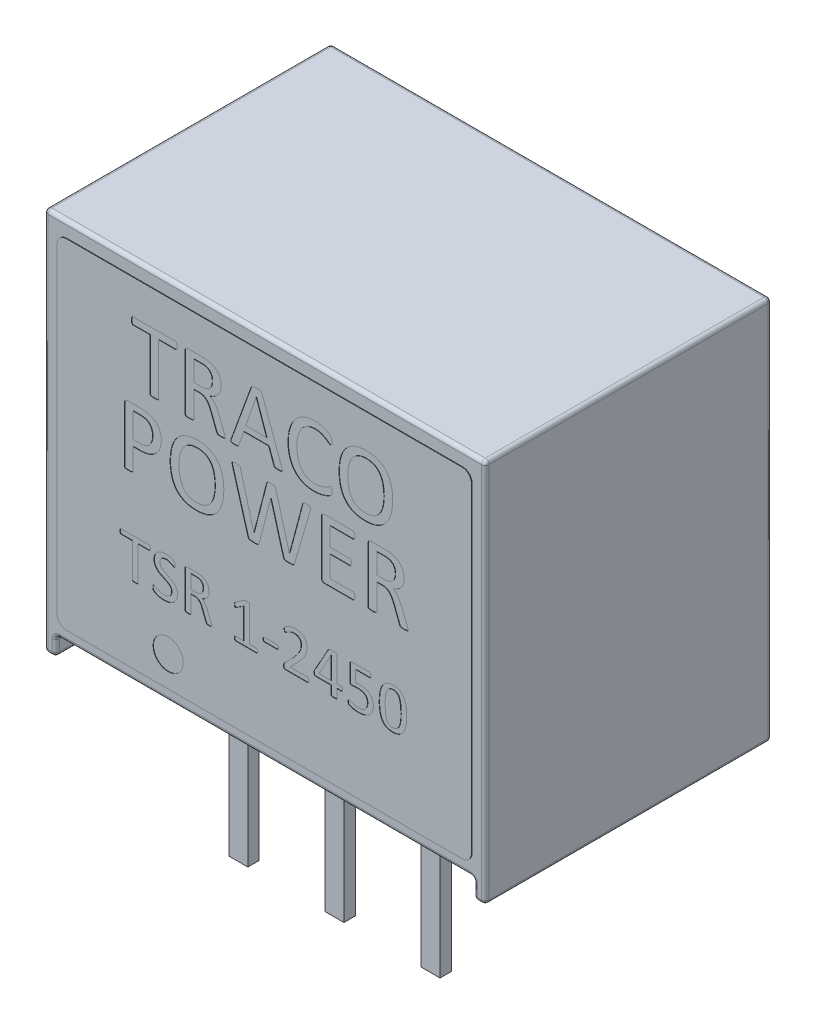
from build123d import *

# Parameters (mm, degrees)
UNIT_BODY_DEPTH = 3.8
SKETCH2_W       = 0.5
SKETCH2_H       = 0.3
PINS_DEPTH      = 4.6
PINS_2_DEPTH    = 4.6
PINS_3_DEPTH    = 4.6
FILLET1_R       = 0.1
LABEL_DEPTH     = 0.015
SKETCH4_R       = 0.4
LABEL_ID_DEPTH  = 0.01


with BuildPart() as part:
    # Sketch1 → Unit Body (new, symmetric)
    with BuildSketch(Plane.XY):
        Polygon((5.55, 0.5), (-5.55, 0.5), (-5.55, 0), (-5.85, 0), (-5.85, 10.2), (5.85, 10.2), (5.85, 0), (5.55, 0), align=None)
    extrude(amount=UNIT_BODY_DEPTH, both=True)

    # Fillet1
    fillet1_edges = [part.edges().sort_by_distance(p)[0] for p in [
        (5.7, 0, 3.8),
        (5.55, 0.25, 3.8),
        (5.55, 0.5, 0),
        (5.55, 0, 0),
        (5.7, 0, -3.8),
        (5.55, 0.25, -3.8),
        (0, 0.5, -3.8),
        (-5.55, 0.25, -3.8),
        (-5.85, 5.1, -3.8),
        (-5.85, 0, 0),
        (-5.55, 0.5, 0),
        (-5.55, 0, 0),
        (0, 0.5, 3.8),
        (-5.55, 0.25, 3.8),
        (-5.7, 0, 3.8),
        (-5.85, 5.1, 3.8),
        (-5.85, 10.2, 0),
        (0, 10.2, 3.8),
        (0, 10.2, -3.8),
        (5.85, 5.1, -3.8),
        (5.85, 10.2, 0),
        (5.85, 5.1, 3.8),
        (5.85, 0, 0),
    ]]
    fillet(fillet1_edges, radius=FILLET1_R)

    # Sketch3 → Label (add)
    with BuildSketch(Plane.XY.offset(3.8)):
        with BuildLine():
            Line((-5.25, 0.8), (5.25, 0.8))
            ThreePointArc((5.25, 0.8), (5.426776695, 0.873223305), (5.5, 1.05))
            Line((5.5, 1.05), (5.5, 9.55))
            ThreePointArc((5.5, 9.55), (5.426776695, 9.726776695), (5.25, 9.8))
            Line((5.25, 9.8), (-5.25, 9.8))
            ThreePointArc((-5.25, 9.8), (-5.426776695, 9.726776695), (-5.5, 9.55))
            Line((-5.5, 9.55), (-5.5, 1.05))
            ThreePointArc((-5.5, 1.05), (-5.426776695, 0.873223305), (-5.25, 0.8))
        make_face()
    extrude(amount=LABEL_DEPTH)

    # Sketch4 → Label ID (cut)
    # profile 1 of 20: a face of its own
    with BuildSketch(Plane.XY.offset(3.815)):
        with Locations((-2.55, 1.6)):
            Circle(SKETCH4_R)
    # profile 2 of 20: a face of its own
    with BuildSketch(Plane.XY.offset(3.815)):
        with BuildLine():
            add(Edge.make_bspline(
                [(-2.311213235, 8.792658548), (-2.311370607, 8.785117313), (-2.311663032, 8.771104283), (-2.313304617, 8.751668214), (-2.316460727, 8.735469454), (-2.321006093, 8.722363039), (-2.327326658, 8.71252991), (-2.33478284, 8.705493434), (-2.343731538, 8.701690901), (-2.349969131, 8.701058856), (-2.353162339, 8.700735294)],
                knots=[0, 0, 0, 0, 1.617147856, 3.004964593, 4.175771152, 5.14910894, 5.958942657, 6.660400347, 7.314219322, 8, 8, 8, 8], degree=3))
            Line((-2.353162339, 8.700735294), (-2.801470588, 8.700735294))
            Line((-2.801470588, 8.700735294), (-2.801470588, 7.338666131))
            add(Edge.make_bspline(
                [(-2.801470588, 7.338666131), (-2.801786438, 7.335710056), (-2.802421585, 7.329765626), (-2.806612243, 7.321264309), (-2.814755897, 7.314247185), (-2.826892072, 7.309463991), (-2.843114093, 7.306268002), (-2.863446291, 7.302251837), (-2.889106461, 7.300354684), (-2.90786241, 7.300126016), (-2.918198529, 7.3)],
                knots=[0, 0, 0, 0, 0.531708879, 1.069224075, 1.657230867, 2.420526847, 3.385286158, 4.628418359, 6.141972353, 8, 8, 8, 8], degree=3))
            add(Edge.make_bspline(
                [(-2.918198529, 7.3), (-2.928289482, 7.300140845), (-2.946919604, 7.300400875), (-2.972479903, 7.302192248), (-2.993000284, 7.306376068), (-3.009352963, 7.309268769), (-3.021354537, 7.314481786), (-3.029788336, 7.321123237), (-3.033964904, 7.329778965), (-3.034607111, 7.335714486), (-3.034926471, 7.338666131)],
                knots=[0, 0, 0, 0, 1.815280807, 3.351408265, 4.595189308, 5.581760803, 6.325475487, 6.930217852, 7.4680136, 8, 8, 8, 8], degree=3))
            Line((-3.034926471, 7.338666131), (-3.034926471, 8.700735294))
            Line((-3.034926471, 8.700735294), (-3.48323472, 8.700735294))
            add(Edge.make_bspline(
                [(-3.48323472, 8.700735294), (-3.486429142, 8.701057939), (-3.492669106, 8.701688191), (-3.501600246, 8.705503997), (-3.509082323, 8.712439145), (-3.51502487, 8.722423708), (-3.519035888, 8.735580692), (-3.522812301, 8.751623346), (-3.524821435, 8.771089897), (-3.525057108, 8.785116671), (-3.525183824, 8.792658548)],
                knots=[0, 0, 0, 0, 0.687029566, 1.342039223, 2.044774351, 2.842090089, 3.808417066, 4.986867355, 6.379907126, 8, 8, 8, 8], degree=3))
            add(Edge.make_bspline(
                [(-3.525183824, 8.792658548), (-3.525061198, 8.800325207), (-3.524830937, 8.814721301), (-3.522726654, 8.834748684), (-3.519261596, 8.85156402), (-3.514431008, 8.865013136), (-3.508985792, 8.875739261), (-3.501051429, 8.882724232), (-3.492155829, 8.887033596), (-3.485712732, 8.887344983), (-3.48250517, 8.8875)],
                knots=[0, 0, 0, 0, 1.598586742, 3.001751243, 4.195634336, 5.166358268, 5.984245811, 6.666657107, 7.336222985, 8, 8, 8, 8], degree=3))
            Line((-3.48250517, 8.8875), (-2.353891889, 8.8875))
            add(Edge.make_bspline(
                [(-2.353891889, 8.8875), (-2.350551858, 8.887380728), (-2.34407725, 8.887149521), (-2.335266316, 8.882618468), (-2.327418522, 8.875670086), (-2.321601241, 8.865057049), (-2.31623745, 8.851679901), (-2.313387998, 8.834704089), (-2.311652024, 8.814707969), (-2.311365795, 8.80032478), (-2.311213235, 8.792658548)],
                knots=[0, 0, 0, 0, 0.687571685, 1.332849124, 2.013867901, 2.842934967, 3.820564279, 5.006892417, 6.404675315, 8, 8, 8, 8], degree=3))
        make_face()
    # profile 3 of 20: a face of its own
    with BuildSketch(Plane.XY.offset(3.815)):
        with BuildLine():
            add(Edge.make_bspline(
                [(-1.036325253, 7.33939568), (-1.036409751, 7.33634015), (-1.03657312, 7.330432606), (-1.03948095, 7.321855138), (-1.046263089, 7.31461754), (-1.056975175, 7.308785409), (-1.072445202, 7.305431391), (-1.092475653, 7.301874874), (-1.118751533, 7.300442095), (-1.138343062, 7.300159543), (-1.149405446, 7.3)],
                knots=[0, 0, 0, 0, 0.552394781, 1.067996698, 1.59843911, 2.308737636, 3.243716164, 4.449494886, 5.995202554, 8, 8, 8, 8], degree=3))
            add(Edge.make_bspline(
                [(-1.149405446, 7.3), (-1.159134345, 7.300151602), (-1.176667642, 7.300424817), (-1.20035659, 7.302000947), (-1.219099937, 7.30519785), (-1.233920055, 7.309785088), (-1.245521072, 7.316553539), (-1.254404603, 7.325753981), (-1.260446591, 7.337736708), (-1.263673813, 7.346415835), (-1.265403837, 7.351068474)],
                knots=[0, 0, 0, 0, 1.682217191, 3.031670033, 4.099618773, 4.963789911, 5.699229685, 6.398004984, 7.141214756, 8, 8, 8, 8], degree=3))
            Line((-1.265403837, 7.351068474), (-1.411678539, 7.729339959))
            add(Edge.make_bspline(
                [(-1.411678539, 7.729339959), (-1.420132809, 7.750089267), (-1.436449341, 7.790134915), (-1.462953329, 7.846816336), (-1.491005154, 7.898148323), (-1.520088379, 7.93457133), (-1.545560476, 7.959862622), (-1.566337861, 7.976306864), (-1.588987737, 7.990214742), (-1.613013703, 8.002421793), (-1.639328388, 8.011975922), (-1.667930199, 8.018924376), (-1.699134466, 8.022846189), (-1.720753525, 8.02341739), (-1.731950827, 8.023713235)],
                knots=[0, 0, 0, 0, 1.715323276, 3.310531238, 4.791054184, 6.182626586, 6.860777511, 7.536944129, 8.206086956, 8.893127879, 9.597119937, 10.344592274, 11.14260373, 12, 12, 12, 12], degree=3))
            Line((-1.731950827, 8.023713235), (-1.867647059, 8.023713235))
            Line((-1.867647059, 8.023713235), (-1.867647059, 7.339760455))
            add(Edge.make_bspline(
                [(-1.867647059, 7.339760455), (-1.867912957, 7.336662183), (-1.868456325, 7.330330817), (-1.873528709, 7.321739073), (-1.881877694, 7.314786939), (-1.893813294, 7.309854957), (-1.90959057, 7.306116271), (-1.929750348, 7.302273871), (-1.955280177, 7.300344049), (-1.974037902, 7.300122237), (-1.984375, 7.3)],
                knots=[0, 0, 0, 0, 0.551870684, 1.127756021, 1.730647335, 2.472085589, 3.418462175, 4.636984023, 6.146692761, 8, 8, 8, 8], degree=3))
            add(Edge.make_bspline(
                [(-1.984375, 7.3), (-1.994708825, 7.300137955), (-2.013581702, 7.300389906), (-2.039268795, 7.302164572), (-2.059549676, 7.306351046), (-2.075636078, 7.309328814), (-2.087531977, 7.314479394), (-2.09596339, 7.321123832), (-2.100199585, 7.329890074), (-2.100798936, 7.335954751), (-2.101102941, 7.339030905)],
                knots=[0, 0, 0, 0, 1.853790896, 3.385616091, 4.604455936, 5.567015365, 6.308647111, 6.911695762, 7.447985294, 8, 8, 8, 8], degree=3))
            Line((-2.101102941, 7.339030905), (-2.101102941, 8.802142693))
            add(Edge.make_bspline(
                [(-2.101102941, 8.802142693), (-2.100895534, 8.809470212), (-2.100506595, 8.823211047), (-2.095839916, 8.841983801), (-2.088102372, 8.857557161), (-2.073319412, 8.872172503), (-2.051464256, 8.884485344), (-2.03231696, 8.886516173), (-2.023041131, 8.8875)],
                knots=[0, 0, 0, 0, 1.007241378, 1.88881631, 2.645546133, 3.368137109, 4.725004673, 6, 6, 6, 6], degree=3))
            Line((-2.023041131, 8.8875), (-1.688177849, 8.8875))
            add(Edge.make_bspline(
                [(-1.688177849, 8.8875), (-1.670053702, 8.887468937), (-1.63706658, 8.887412402), (-1.591489111, 8.88441535), (-1.552809611, 8.881601244), (-1.52901, 8.879161937), (-1.51782801, 8.878015855)],
                knots=[0, 0, 0, 0, 1.27372654, 2.318264775, 3.209854915, 4, 4, 4, 4], degree=3))
            add(Edge.make_bspline(
                [(-1.51782801, 8.878015855), (-1.503092886, 8.875097505), (-1.474183991, 8.869371984), (-1.432227056, 8.858933037), (-1.393412667, 8.844486435), (-1.35672563, 8.829299427), (-1.323234637, 8.810669792), (-1.29187444, 8.790982036), (-1.264109874, 8.767929412), (-1.238688763, 8.74324996), (-1.216718546, 8.715990434), (-1.1963175, 8.687643688), (-1.180824127, 8.656279693), (-1.166863881, 8.623832371), (-1.156963721, 8.589197213), (-1.149066633, 8.553061103), (-1.144778905, 8.515046643), (-1.144218488, 8.489175381), (-1.143933824, 8.476034007)],
                knots=[0, 0, 0, 0, 1.191122015, 2.336866698, 3.42242524, 4.471809322, 5.481243804, 6.457256698, 7.402799425, 8.336721758, 9.26124262, 10.175808252, 11.098517904, 12.027701383, 12.97324411, 13.948876047, 14.958126376, 16, 16, 16, 16], degree=3))
            add(Edge.make_bspline(
                [(-1.143933824, 8.476034007), (-1.144266432, 8.463259775), (-1.144914009, 8.438388752), (-1.148431104, 8.402001157), (-1.154983287, 8.367705989), (-1.164255046, 8.335451232), (-1.175336499, 8.305015671), (-1.189526028, 8.276748625), (-1.205472219, 8.250047343), (-1.229941903, 8.216852309), (-1.266205117, 8.179362202), (-1.317115571, 8.140834299), (-1.375266373, 8.108759065), (-1.417191937, 8.092081042), (-1.438671875, 8.083536305)],
                knots=[0, 0, 0, 0, 0.870093262, 1.69404378, 2.48656215, 3.244089618, 3.9777523, 4.688775412, 5.394571765, 6.09348547, 7.493200162, 8.929089906, 10.426664953, 12, 12, 12, 12], degree=3))
            add(Edge.make_bspline(
                [(-1.438671875, 8.083536305), (-1.425902042, 8.077511994), (-1.400585596, 8.065568679), (-1.36677434, 8.040084521), (-1.335246577, 8.010656612), (-1.306585062, 7.975520526), (-1.279256088, 7.935485097), (-1.254560601, 7.889314436), (-1.229337315, 7.838008089), (-1.21423182, 7.801180411), (-1.206310317, 7.781867532)],
                knots=[0, 0, 0, 0, 0.864679079, 1.714243352, 2.585566623, 3.507869762, 4.491310941, 5.557114259, 6.718921253, 8, 8, 8, 8], degree=3))
            Line((-1.206310317, 7.781867532), (-1.063318589, 7.429859835))
            add(Edge.make_bspline(
                [(-1.063318589, 7.429859835), (-1.060796337, 7.423039744), (-1.056112154, 7.410373861), (-1.049309167, 7.393317893), (-1.045087285, 7.379148495), (-1.040853327, 7.36576905), (-1.037130038, 7.352978395), (-1.036564152, 7.343427686), (-1.036325253, 7.33939568)],
                knots=[0, 0, 0, 0, 1.38137286, 2.56540674, 3.485806926, 4.187128033, 5.23466316, 6, 6, 6, 6], degree=3))
        make_face()
        with BuildLine():
            add(Edge.make_bspline(
                [(-1.377389706, 8.456700942), (-1.377916661, 8.471799786), (-1.378929793, 8.500829027), (-1.385649489, 8.542812763), (-1.398263045, 8.580746369), (-1.414897211, 8.61555763), (-1.437965722, 8.646053452), (-1.467559851, 8.67207498), (-1.503740975, 8.693394179), (-1.531003021, 8.70302194), (-1.545186121, 8.70803079)],
                knots=[0, 0, 0, 0, 1.106837018, 2.128019726, 3.103131596, 4.027783155, 4.943935065, 5.884596147, 6.899459546, 8, 8, 8, 8], degree=3))
            add(Edge.make_bspline(
                [(-1.545186121, 8.70803079), (-1.555227476, 8.710816432), (-1.576282331, 8.716657405), (-1.604438489, 8.720257951), (-1.62956727, 8.721890411), (-1.65154898, 8.723732032), (-1.676387432, 8.723630375), (-1.693894087, 8.723925253), (-1.703133617, 8.724080882)],
                knots=[0, 0, 0, 0, 1.17598894, 2.465830294, 3.195893525, 4.021865782, 4.955995349, 6, 6, 6, 6], degree=3))
            Line((-1.703133617, 8.724080882), (-1.867647059, 8.724080882))
            Line((-1.867647059, 8.724080882), (-1.867647059, 8.187132353))
            Line((-1.867647059, 8.187132353), (-1.67686983, 8.187132353))
            add(Edge.make_bspline(
                [(-1.67686983, 8.187132353), (-1.664453674, 8.187258266), (-1.640401221, 8.187502184), (-1.605788124, 8.191750505), (-1.573655597, 8.197823028), (-1.544012757, 8.206468233), (-1.517017726, 8.21791637), (-1.49221834, 8.231040565), (-1.469945302, 8.246489207), (-1.449760581, 8.263582828), (-1.432068776, 8.282664396), (-1.417208225, 8.303672671), (-1.40417068, 8.325839141), (-1.391149408, 8.358186972), (-1.37971071, 8.401848183), (-1.37817531, 8.438134603), (-1.377389706, 8.456700942)],
                knots=[0, 0, 0, 0, 1.139982929, 2.208363576, 3.198662771, 4.142437321, 5.038734787, 5.888427894, 6.715795914, 7.524011596, 8.31458568, 9.098978977, 9.884644091, 10.670944343, 12.296652677, 14, 14, 14, 14], degree=3))
        make_face(mode=Mode.SUBTRACT)
    # profile 4 of 20: a face of its own
    with BuildSketch(Plane.XY.offset(3.815)):
        with BuildLine():
            add(Edge.make_bspline(
                [(0.470924288, 7.381344784), (0.473795008, 7.373395905), (0.478840477, 7.359425257), (0.481642636, 7.339888568), (0.480772159, 7.323931362), (0.472289548, 7.311670565), (0.457349242, 7.304933113), (0.437188297, 7.301422064), (0.410249661, 7.300606296), (0.390061558, 7.30021912), (0.378636259, 7.3)],
                knots=[0, 0, 0, 0, 1.20658454, 2.120647273, 2.822909938, 3.436613703, 4.145757244, 5.10581043, 6.362056075, 8, 8, 8, 8], degree=3))
            add(Edge.make_bspline(
                [(0.378636259, 7.3), (0.367208212, 7.3000389), (0.346770992, 7.300108467), (0.319694311, 7.30125092), (0.299268945, 7.303994954), (0.28403121, 7.306718173), (0.273038096, 7.311942136), (0.265481471, 7.319201199), (0.260142109, 7.327975349), (0.256995829, 7.33426593), (0.255342371, 7.337571806)],
                knots=[0, 0, 0, 0, 1.98472369, 3.549358147, 4.698993141, 5.564621514, 6.225559426, 6.778136562, 7.357876606, 8, 8, 8, 8], degree=3))
            Line((0.255342371, 7.337571806), (0.11891659, 7.720220588))
            Line((0.11891659, 7.720220588), (-0.543514476, 7.720220588))
            Line((-0.543514476, 7.720220588), (-0.67410386, 7.342678653))
            add(Edge.make_bspline(
                [(-0.67410386, 7.342678653), (-0.675468466, 7.339235193), (-0.678100868, 7.332592563), (-0.683607827, 7.323320356), (-0.691763292, 7.315843369), (-0.702513444, 7.309264028), (-0.717371612, 7.304785709), (-0.736826625, 7.301517914), (-0.761889501, 7.300592934), (-0.78049955, 7.300211675), (-0.790831801, 7.3)],
                knots=[0, 0, 0, 0, 0.663060064, 1.27908053, 1.910294906, 2.623277198, 3.518069493, 4.666729453, 6.149376829, 8, 8, 8, 8], degree=3))
            add(Edge.make_bspline(
                [(-0.790831801, 7.3), (-0.801643843, 7.300157847), (-0.821230808, 7.3004438), (-0.847572237, 7.301950999), (-0.867224657, 7.306530733), (-0.882096357, 7.313013652), (-0.889423041, 7.325542377), (-0.890734617, 7.34108137), (-0.887180461, 7.360498003), (-0.882265354, 7.374488347), (-0.879472082, 7.382439108)],
                knots=[0, 0, 0, 0, 1.579143439, 2.860757301, 3.828777215, 4.535214375, 5.14067361, 5.838145468, 6.771410487, 8, 8, 8, 8], degree=3))
            Line((-0.879472082, 7.382439108), (-0.345441751, 8.845186121))
            add(Edge.make_bspline(
                [(-0.345441751, 8.845186121), (-0.343640042, 8.849152085), (-0.340186426, 8.856754266), (-0.332679681, 8.866848832), (-0.322056739, 8.874551807), (-0.307971011, 8.879807401), (-0.290173977, 8.883714769), (-0.267797713, 8.886031039), (-0.24016303, 8.887441698), (-0.219840175, 8.887479299), (-0.208651195, 8.8875)],
                knots=[0, 0, 0, 0, 0.683309499, 1.30980594, 1.951546434, 2.714075901, 3.654596571, 4.80831387, 6.242780742, 8, 8, 8, 8], degree=3))
            add(Edge.make_bspline(
                [(-0.208651195, 8.8875), (-0.196611617, 8.887480643), (-0.174831432, 8.887445624), (-0.145248876, 8.886033479), (-0.121551294, 8.883725651), (-0.102697663, 8.879897487), (-0.087973734, 8.874150636), (-0.076643659, 8.86623519), (-0.06869527, 8.855742278), (-0.065252279, 8.847824047), (-0.063470818, 8.843727022)],
                knots=[0, 0, 0, 0, 1.785799845, 3.230599435, 4.391881448, 5.315322, 6.075681796, 6.721513625, 7.338489756, 8, 8, 8, 8], degree=3))
            Line((-0.063470818, 8.843727022), (0.470924288, 7.381344784))
        make_face()
        Polygon((-0.214852367, 8.677389706), (-0.215946691, 8.677389706), (-0.490622128, 7.883639706), (0.063470818, 7.883639706), align=None, mode=Mode.SUBTRACT)
    # profile 5 of 20: a face of its own
    with BuildSketch(Plane.XY.offset(3.815)):
        with BuildLine():
            add(Edge.make_bspline(
                [(1.797610294, 7.50755687), (1.797573312, 7.501229106), (1.797504262, 7.489414252), (1.796165177, 7.472902974), (1.79521099, 7.458385643), (1.791931891, 7.446078215), (1.788896229, 7.434987153), (1.783878003, 7.425147372), (1.77665389, 7.415188564), (1.767998878, 7.406614561), (1.757694182, 7.398803977), (1.746320751, 7.391213732), (1.731624801, 7.382051725), (1.706244776, 7.367300115), (1.667537683, 7.348123977), (1.613414994, 7.326363663), (1.549836344, 7.306972308), (1.477977916, 7.29014186), (1.397947225, 7.278352101), (1.341929874, 7.277234889), (1.312824563, 7.276654412)],
                knots=[0, 0, 0, 0, 0.57946178, 1.081939299, 1.518734738, 1.90788836, 2.246191962, 2.570061064, 2.913282392, 3.37021711, 3.679981085, 4.097153101, 4.622693576, 5.266683985, 6.78637746, 8.575991717, 10.60581333, 12.870568803, 15.334867022, 18, 18, 18, 18], degree=3))
            add(Edge.make_bspline(
                [(1.312824563, 7.276654412), (1.287375978, 7.277245689), (1.237497073, 7.278404585), (1.164621543, 7.288653241), (1.095337889, 7.304366506), (1.030137084, 7.327253498), (0.968850104, 7.355722697), (0.912757206, 7.3918291), (0.860552929, 7.432870609), (0.81362026, 7.480860962), (0.771586564, 7.534711373), (0.734533753, 7.59446755), (0.703358448, 7.660355738), (0.676495814, 7.731595574), (0.6558667, 7.808964146), (0.641154831, 7.891941076), (0.631768948, 7.980576561), (0.630819601, 8.041562579), (0.630330882, 8.072957835)],
                knots=[0, 0, 0, 0, 1.027278517, 2.013452943, 2.9663862, 3.891989736, 4.799199612, 5.688801468, 6.579960621, 7.475856175, 8.392374808, 9.33401815, 10.309213362, 11.331691925, 12.404982327, 13.537738022, 14.732441495, 16, 16, 16, 16], degree=3))
            add(Edge.make_bspline(
                [(0.630330882, 8.072957835), (0.630908611, 8.105208811), (0.632032054, 8.167923603), (0.642254209, 8.259233687), (0.657890316, 8.345232362), (0.680681597, 8.425720408), (0.708933065, 8.500643363), (0.743031797, 8.569602694), (0.78215398, 8.632710695), (0.826343043, 8.689995987), (0.875860647, 8.740782837), (0.929685948, 8.785740454), (0.988486892, 8.823897748), (1.051848697, 8.85523331), (1.119098632, 8.8800653), (1.189978471, 8.89802827), (1.264467818, 8.908752852), (1.315342568, 8.910138981), (1.341276999, 8.910845588)],
                knots=[0, 0, 0, 0, 1.249708279, 2.430165073, 3.557005348, 4.634290471, 5.668064499, 6.656627248, 7.61135399, 8.541854588, 9.45511428, 10.355476443, 11.254888225, 12.165456175, 13.090005283, 14.028504788, 14.994990531, 16, 16, 16, 16], degree=3))
            add(Edge.make_bspline(
                [(1.341276999, 8.910845588), (1.364304769, 8.910158417), (1.409996145, 8.908794941), (1.476792352, 8.897535456), (1.540211857, 8.882177075), (1.598942756, 8.862412045), (1.652423869, 8.839774181), (1.692147326, 8.817479752), (1.719353294, 8.798693194), (1.73660322, 8.787144368), (1.749954255, 8.775927002), (1.762504589, 8.763853715), (1.773225709, 8.751638863), (1.782319843, 8.739781175), (1.787958365, 8.729355236), (1.790786011, 8.718172559), (1.794022263, 8.705488572), (1.7959648, 8.690564806), (1.797591547, 8.672926555), (1.797603664, 8.660250935), (1.797610294, 8.653314568)],
                knots=[0, 0, 0, 0, 2.160421975, 4.286678681, 6.343694476, 8.282100594, 10.097203334, 11.78914257, 12.545800799, 13.201334553, 13.736250938, 14.180257305, 14.835293953, 15.259950455, 15.58159781, 15.939121017, 16.33782415, 16.810817332, 17.34925414, 18, 18, 18, 18], degree=3))
            add(Edge.make_bspline(
                [(1.797610294, 8.653314568), (1.797448681, 8.645774045), (1.797150968, 8.631883347), (1.79559878, 8.612797129), (1.792193392, 8.596915269), (1.787889502, 8.583981287), (1.783136512, 8.573267026), (1.776278236, 8.565929422), (1.76803058, 8.561470149), (1.762038621, 8.560937067), (1.758944164, 8.560661765)],
                knots=[0, 0, 0, 0, 1.645009513, 3.030337633, 4.169404101, 5.175714888, 6.005878933, 6.699937577, 7.328602226, 8, 8, 8, 8], degree=3))
            add(Edge.make_bspline(
                [(1.758944164, 8.560661765), (1.755730996, 8.56096645), (1.748363059, 8.561665106), (1.737285667, 8.567692476), (1.723766758, 8.575103343), (1.703338146, 8.591758666), (1.672324719, 8.615375412), (1.636341606, 8.638570902), (1.6030639, 8.657862518), (1.574639476, 8.672655813), (1.543069311, 8.685776397), (1.509293449, 8.699231285), (1.472258829, 8.710815861), (1.431527299, 8.718606384), (1.387233876, 8.723412266), (1.356489289, 8.723852572), (1.340547449, 8.724080882)],
                knots=[0, 0, 0, 0, 0.292872052, 0.671568788, 1.135576066, 1.707833298, 3.075012848, 4.708579322, 5.621376181, 6.59730594, 7.639625393, 8.749891996, 9.926131855, 11.18596977, 12.540854699, 14, 14, 14, 14], degree=3))
            add(Edge.make_bspline(
                [(1.340547449, 8.724080882), (1.323006355, 8.723639124), (1.288582989, 8.7227722), (1.238143312, 8.714482672), (1.190197079, 8.700973026), (1.144710988, 8.682365272), (1.10226784, 8.658517753), (1.062683718, 8.629792625), (1.026626804, 8.595659602), (0.993657621, 8.55672593), (0.964003398, 8.513115708), (0.938169524, 8.464744312), (0.915943892, 8.411804238), (0.8970314, 8.354642021), (0.881994639, 8.293065989), (0.871725213, 8.227167083), (0.864918877, 8.156998239), (0.864171197, 8.108722733), (0.863786765, 8.08390108)],
                knots=[0, 0, 0, 0, 0.937239186, 1.839276762, 2.724215351, 3.595849091, 4.460277111, 5.321079652, 6.204105891, 7.108085726, 8.043903433, 9.018284048, 10.034947041, 11.110118944, 12.234328641, 13.419585464, 14.673236994, 16, 16, 16, 16], degree=3))
            add(Edge.make_bspline(
                [(0.863786765, 8.08390108), (0.864214304, 8.059447893), (0.865047419, 8.011797747), (0.871275208, 7.942576498), (0.881429997, 7.877602984), (0.895458461, 7.817043462), (0.913687426, 7.761030218), (0.935598227, 7.709779082), (0.96074052, 7.663079188), (0.98953308, 7.621170665), (1.022438992, 7.58438395), (1.058489315, 7.552043012), (1.098430944, 7.524996414), (1.141290603, 7.501998618), (1.187735724, 7.484717982), (1.23713123, 7.472196399), (1.28950482, 7.464909064), (1.325447439, 7.463923294), (1.343830423, 7.463419118)],
                knots=[0, 0, 0, 0, 1.320077353, 2.572338703, 3.74872608, 4.868124565, 5.924784502, 6.924678379, 7.873488123, 8.783985269, 9.662787268, 10.532321337, 11.391760867, 12.260997523, 13.152264731, 14.059798898, 15.007677089, 16, 16, 16, 16], degree=3))
            add(Edge.make_bspline(
                [(1.343830423, 7.463419118), (1.359160143, 7.463712554), (1.389022335, 7.464284165), (1.432167301, 7.468297328), (1.472459999, 7.47473001), (1.509584385, 7.484254688), (1.543856822, 7.495993415), (1.575832188, 7.507219345), (1.60498034, 7.519848289), (1.638912172, 7.5367013), (1.6754075, 7.557005443), (1.707484308, 7.577056283), (1.728883144, 7.590940513), (1.742542106, 7.597811909), (1.754535429, 7.602363761), (1.762076605, 7.603139467), (1.76551011, 7.603492647)],
                knots=[0, 0, 0, 0, 1.426600294, 2.779007716, 4.029214706, 5.220409842, 6.340517032, 7.400169128, 8.373455944, 9.294554226, 10.925704598, 12.257212739, 12.816207766, 13.296993568, 13.679920379, 14, 14, 14, 14], degree=3))
            add(Edge.make_bspline(
                [(1.76551011, 7.603492647), (1.76821453, 7.603283716), (1.773318149, 7.602889432), (1.780532361, 7.599787584), (1.786510813, 7.593649751), (1.790505571, 7.583938674), (1.794298604, 7.571030681), (1.795982675, 7.553908179), (1.797622435, 7.532396859), (1.797614636, 7.516439928), (1.797610294, 7.50755687)],
                knots=[0, 0, 0, 0, 0.582809616, 1.099843627, 1.656656807, 2.384547924, 3.340005016, 4.557660371, 6.083685199, 8, 8, 8, 8], degree=3))
        make_face()
    # profile 6 of 20: a face of its own
    with BuildSketch(Plane.XY.offset(3.815)):
        with BuildLine():
            add(Edge.make_bspline(
                [(3.408455882, 8.111988741), (3.407884156, 8.08072143), (3.406765268, 8.019530196), (3.398372845, 7.930158582), (3.384227827, 7.84539067), (3.364253564, 7.765601677), (3.338945804, 7.69084265), (3.307483055, 7.621930054), (3.270420971, 7.558758095), (3.228145317, 7.501045676), (3.179610406, 7.449622957), (3.125382313, 7.404494852), (3.06511761, 7.365919727), (2.999396481, 7.333387938), (2.927802916, 7.307782555), (2.850603049, 7.28969189), (2.767748573, 7.278580218), (2.710556181, 7.277309164), (2.681094899, 7.276654412)],
                knots=[0, 0, 0, 0, 1.19137641, 2.331565767, 3.417042525, 4.463281839, 5.462606823, 6.420512668, 7.344711138, 8.249186097, 9.140739235, 10.032400728, 10.93079057, 11.861193805, 12.821170558, 13.821397441, 14.877745384, 16, 16, 16, 16], degree=3))
            add(Edge.make_bspline(
                [(2.681094899, 7.276654412), (2.652120101, 7.277195994), (2.595923725, 7.278246388), (2.514784875, 7.288845782), (2.439464687, 7.304769369), (2.370320185, 7.328257068), (2.307252903, 7.358313334), (2.249710335, 7.394269534), (2.197994244, 7.43642932), (2.1519742, 7.484742474), (2.111547263, 7.539064096), (2.077411044, 7.599853939), (2.048021916, 7.666241343), (2.02446304, 7.738878242), (2.006350714, 7.817380163), (1.993985319, 7.901691129), (1.985601114, 7.991444333), (1.984791203, 8.053239582), (1.984375, 8.084995404)],
                knots=[0, 0, 0, 0, 1.137445095, 2.206065128, 3.208407631, 4.156851521, 5.066857725, 5.946688419, 6.815641936, 7.680385637, 8.56104548, 9.467951058, 10.41303433, 11.408286435, 12.462476973, 13.573548823, 14.753076423, 16, 16, 16, 16], degree=3))
            add(Edge.make_bspline(
                [(1.984375, 8.084995404), (1.984937124, 8.11565631), (1.986034566, 8.17551604), (1.994549238, 8.263172171), (2.00856945, 8.346505628), (2.028719962, 8.425387427), (2.053769428, 8.499515209), (2.085491716, 8.567813945), (2.122253409, 8.630658197), (2.165208125, 8.687597729), (2.213923448, 8.738533663), (2.268335849, 8.783464973), (2.328579771, 8.821819686), (2.39433581, 8.85412483), (2.465859036, 8.879789362), (2.543330448, 8.897793486), (2.626420808, 8.908906338), (2.683733795, 8.910187181), (2.713195083, 8.910845588)],
                knots=[0, 0, 0, 0, 1.175256309, 2.294469895, 3.372697637, 4.411680733, 5.412616409, 6.367821432, 7.293569431, 8.198811264, 9.095564309, 9.989623777, 10.897346502, 11.827111084, 12.792869429, 13.803655498, 14.870986452, 16, 16, 16, 16], degree=3))
            add(Edge.make_bspline(
                [(2.713195083, 8.910845588), (2.741553856, 8.910243056), (2.796628538, 8.909072897), (2.876438972, 8.89925706), (2.950469991, 8.882504459), (3.018938955, 8.859415992), (3.082021467, 8.830381634), (3.139471064, 8.794553861), (3.191653438, 8.752930579), (3.237867923, 8.704647206), (3.27847289, 8.650501775), (3.314304304, 8.590852827), (3.343097255, 8.524520751), (3.367326293, 8.452807174), (3.385612788, 8.375204081), (3.399039755, 8.292329367), (3.407184671, 8.203953568), (3.408023688, 8.143255541), (3.408455882, 8.111988741)],
                knots=[0, 0, 0, 0, 1.124252185, 2.183374782, 3.182256192, 4.129105229, 5.043721226, 5.929425601, 6.80741917, 7.683782861, 8.571911764, 9.486451506, 10.436181025, 11.433338738, 12.484662547, 13.593591443, 14.760409517, 16, 16, 16, 16], degree=3))
        make_face()
        with BuildLine():
            add(Edge.make_bspline(
                [(3.175, 8.096303424), (3.174715439, 8.118195824), (3.174155217, 8.161295909), (3.169868207, 8.224760813), (3.161984713, 8.285822632), (3.152065622, 8.344358725), (3.138943615, 8.400073646), (3.120823347, 8.451942464), (3.099520857, 8.500386776), (3.073797649, 8.544750998), (3.044348553, 8.585349258), (3.009691534, 8.621045359), (2.970328567, 8.651791952), (2.926457412, 8.678032305), (2.877462595, 8.69899926), (2.82311026, 8.713797087), (2.763333944, 8.722583003), (2.721737804, 8.723567755), (2.700063189, 8.724080882)],
                knots=[0, 0, 0, 0, 1.169250427, 2.301930944, 3.395008842, 4.456274514, 5.472222399, 6.447763327, 7.38673591, 8.294558986, 9.18170536, 10.058907655, 10.942338117, 11.842252221, 12.781965628, 13.779311434, 14.842859721, 16, 16, 16, 16], degree=3))
            add(Edge.make_bspline(
                [(2.700063189, 8.724080882), (2.678381569, 8.723480465), (2.636740211, 8.722327314), (2.576815399, 8.712704581), (2.522243581, 8.696943199), (2.473047408, 8.674309177), (2.429232972, 8.646373647), (2.389585262, 8.614167415), (2.354156229, 8.577798939), (2.323496301, 8.53684156), (2.296646547, 8.492401783), (2.27407387, 8.444214622), (2.255951098, 8.392303451), (2.241349317, 8.33743321), (2.231197913, 8.279884481), (2.223520004, 8.220731527), (2.218554123, 8.160102088), (2.218073647, 8.1191722), (2.217830882, 8.098492073)],
                knots=[0, 0, 0, 0, 1.161109193, 2.230006939, 3.242146217, 4.195396554, 5.120768157, 6.019191557, 6.926803525, 7.833666984, 8.754302376, 9.704386277, 10.67901314, 11.696672534, 12.743199842, 13.807421854, 14.892183724, 16, 16, 16, 16], degree=3))
            add(Edge.make_bspline(
                [(2.217830882, 8.098492073), (2.218090258, 8.075867625), (2.218599751, 8.031426361), (2.223213674, 7.966205198), (2.229866954, 7.903573649), (2.239987892, 7.843973034), (2.253383022, 7.787596752), (2.270254177, 7.734942425), (2.291656877, 7.686369257), (2.316678878, 7.641614343), (2.346215727, 7.601202498), (2.38067449, 7.565715973), (2.41957573, 7.535001124), (2.46308403, 7.508599892), (2.51223044, 7.488086911), (2.56697725, 7.473761452), (2.627427527, 7.464879567), (2.669632381, 7.463920158), (2.691673369, 7.463419118)],
                knots=[0, 0, 0, 0, 1.196993268, 2.351257178, 3.458234918, 4.528672635, 5.547698982, 6.522289971, 7.449941179, 8.351729023, 9.230641879, 10.090605086, 10.960784804, 11.846827774, 12.775304165, 13.767908032, 14.834316289, 16, 16, 16, 16], degree=3))
            add(Edge.make_bspline(
                [(2.691673369, 7.463419118), (2.713475102, 7.464028641), (2.755475555, 7.465202872), (2.815895574, 7.474750227), (2.870944916, 7.490556359), (2.920489524, 7.513203118), (2.964933471, 7.541194702), (3.004781199, 7.573758242), (3.040319999, 7.610638018), (3.070969991, 7.652093909), (3.097088968, 7.697728992), (3.119888391, 7.746394082), (3.137601911, 7.798873246), (3.151763233, 7.854133231), (3.162022293, 7.912108192), (3.169811533, 7.971981133), (3.174149585, 8.03361871), (3.174714537, 8.075261764), (3.175, 8.096303424)],
                knots=[0, 0, 0, 0, 1.156546549, 2.228055893, 3.236790421, 4.186873135, 5.108930184, 6.01699397, 6.911520701, 7.820111692, 8.745392135, 9.698166525, 10.66751403, 11.680142067, 12.723095794, 13.790029056, 14.883332216, 16, 16, 16, 16], degree=3))
        make_face(mode=Mode.SUBTRACT)
    # profile 7 of 20: a face of its own
    with BuildSketch(Plane.XY.offset(3.815)):
        with BuildLine():
            add(Edge.make_bspline(
                [(-2.731433824, 6.424235983), (-2.731963789, 6.404883463), (-2.732997229, 6.367145777), (-2.73991578, 6.311889729), (-2.751953018, 6.259594374), (-2.768765191, 6.210244655), (-2.789840398, 6.164037395), (-2.815662195, 6.121508099), (-2.845214652, 6.082246316), (-2.879037817, 6.04670397), (-2.91676874, 6.014621421), (-2.959035119, 5.987078872), (-3.005010257, 5.962758291), (-3.055159963, 5.942292145), (-3.109991051, 5.926102942), (-3.169662829, 5.915183464), (-3.234282603, 5.907991023), (-3.279061239, 5.907328973), (-3.302306411, 5.906985294)],
                knots=[0, 0, 0, 0, 1.064022205, 2.074858222, 3.056009068, 4.009505882, 4.936838701, 5.842617437, 6.739818857, 7.63360131, 8.534977633, 9.456532771, 10.401554308, 11.391029079, 12.429692271, 13.538959549, 14.722441952, 16, 16, 16, 16], degree=3))
            Line((-3.302306411, 5.906985294), (-3.478492647, 5.906985294))
            Line((-3.478492647, 5.906985294), (-3.478492647, 5.339030905))
            add(Edge.make_bspline(
                [(-3.478492647, 5.339030905), (-3.478737443, 5.335921604), (-3.479229316, 5.329674032), (-3.484505332, 5.321329377), (-3.49271055, 5.314430863), (-3.504614046, 5.309409992), (-3.520504858, 5.306278246), (-3.540581183, 5.302211618), (-3.566130847, 5.300365493), (-3.584885295, 5.300129856), (-3.595220588, 5.3)],
                knots=[0, 0, 0, 0, 0.55354233, 1.112241998, 1.716959502, 2.460643612, 3.404584452, 4.626797268, 6.141078995, 8, 8, 8, 8], degree=3))
            add(Edge.make_bspline(
                [(-3.595220588, 5.3), (-3.605554414, 5.300137955), (-3.62442729, 5.300389906), (-3.650114384, 5.302164572), (-3.670395264, 5.306351046), (-3.686481666, 5.309328814), (-3.698377565, 5.314479394), (-3.706808979, 5.321123832), (-3.711045173, 5.329890074), (-3.711644524, 5.335954751), (-3.711948529, 5.339030905)],
                knots=[0, 0, 0, 0, 1.853790896, 3.385616091, 4.604455936, 5.567015365, 6.308647111, 6.911695762, 7.447985294, 8, 8, 8, 8], degree=3))
            Line((-3.711948529, 5.339030905), (-3.711948529, 6.797035846))
            add(Edge.make_bspline(
                [(-3.711948529, 6.797035846), (-3.711783405, 6.804615226), (-3.711472587, 6.818882084), (-3.706208472, 6.838430097), (-3.698332641, 6.854884427), (-3.686479611, 6.867165112), (-3.67298181, 6.875922411), (-3.658888409, 6.882972627), (-3.643656805, 6.886474857), (-3.633292286, 6.887155671), (-3.628050322, 6.8875)],
                knots=[0, 0, 0, 0, 1.299040081, 2.445215624, 3.455133985, 4.401819712, 5.335485566, 6.214649835, 7.097040406, 8, 8, 8, 8], degree=3))
            Line((-3.628050322, 6.8875), (-3.286621094, 6.8875))
            add(Edge.make_bspline(
                [(-3.286621094, 6.8875), (-3.269715072, 6.887292862), (-3.236599566, 6.886887119), (-3.186042659, 6.883491855), (-3.13227785, 6.876678417), (-3.08391271, 6.867528791), (-3.041959243, 6.856409199), (-3.008978597, 6.844823807), (-2.975747127, 6.829937564), (-2.942689774, 6.812315958), (-2.91060744, 6.79227072), (-2.88066381, 6.769748128), (-2.853286229, 6.7450924), (-2.828791905, 6.717726188), (-2.806366817, 6.688670768), (-2.786961258, 6.656937178), (-2.770217407, 6.623124548), (-2.756386632, 6.587051551), (-2.744949486, 6.549196233), (-2.736995565, 6.509136859), (-2.732169248, 6.467278012), (-2.731681275, 6.438718532), (-2.731433824, 6.424235983)],
                knots=[0, 0, 0, 0, 1.236653427, 2.422356082, 3.704337378, 5.199311302, 6.019218855, 6.877224741, 7.753252656, 8.680396126, 9.615695692, 10.517621633, 11.418099048, 12.306012693, 13.2008494, 14.099391815, 15.02225877, 15.957177609, 16.922448958, 17.911523762, 18.94093102, 20, 20, 20, 20], degree=3))
        make_face()
        with BuildLine():
            add(Edge.make_bspline(
                [(-2.964889706, 6.407821117), (-2.965324254, 6.423766295), (-2.966160414, 6.454448136), (-2.972100382, 6.498491527), (-2.983161818, 6.538268982), (-2.998116447, 6.573903577), (-3.016448145, 6.605103504), (-3.036454469, 6.632547856), (-3.058974453, 6.655490266), (-3.083512795, 6.674079216), (-3.109149509, 6.688769154), (-3.134923504, 6.701327444), (-3.161509515, 6.709881793), (-3.19706048, 6.717431393), (-3.241231412, 6.722658332), (-3.276516136, 6.723611053), (-3.29391659, 6.724080882)],
                knots=[0, 0, 0, 0, 1.281252398, 2.46539624, 3.560542967, 4.589445221, 5.561382385, 6.462213449, 7.312005788, 8.13468678, 8.927287187, 9.683398093, 10.434187776, 11.164350965, 12.601616375, 14, 14, 14, 14], degree=3))
            Line((-3.29391659, 6.724080882), (-3.478492647, 6.724080882))
            Line((-3.478492647, 6.724080882), (-3.478492647, 6.070404412))
            Line((-3.478492647, 6.070404412), (-3.298293888, 6.070404412))
            add(Edge.make_bspline(
                [(-3.298293888, 6.070404412), (-3.283810513, 6.070629006), (-3.256095153, 6.07105879), (-3.216383532, 6.075821411), (-3.180557516, 6.083724005), (-3.148231141, 6.094738787), (-3.119321189, 6.10883986), (-3.092739843, 6.124833606), (-3.06883786, 6.143688073), (-3.047197114, 6.164976353), (-3.027924375, 6.188543587), (-3.011303752, 6.214561782), (-2.99717726, 6.24256164), (-2.985429415, 6.272609496), (-2.976555151, 6.304434991), (-2.969261977, 6.33761647), (-2.96594378, 6.372371278), (-2.965244144, 6.395900928), (-2.964889706, 6.407821117)],
                knots=[0, 0, 0, 0, 1.290506874, 2.469511706, 3.55811762, 4.555551737, 5.505697177, 6.420248641, 7.315719165, 8.212435082, 9.121446492, 10.02338731, 10.958892689, 11.912924725, 12.894031179, 13.901601307, 14.936945112, 16, 16, 16, 16], degree=3))
        make_face(mode=Mode.SUBTRACT)
    # profile 8 of 20: a face of its own
    with BuildSketch(Plane.XY.offset(3.815)):
        with BuildLine():
            add(Edge.make_bspline(
                [(-1.073897059, 6.111988741), (-1.074468785, 6.08072143), (-1.075587674, 6.019530196), (-1.083980096, 5.930158582), (-1.098125114, 5.84539067), (-1.118099378, 5.765601677), (-1.143407138, 5.69084265), (-1.174869886, 5.621930054), (-1.21193197, 5.558758095), (-1.254207624, 5.501045676), (-1.302742535, 5.449622957), (-1.356970628, 5.404494852), (-1.417235331, 5.365919727), (-1.48295646, 5.333387938), (-1.554550026, 5.307782555), (-1.631749892, 5.28969189), (-1.714604369, 5.278580218), (-1.77179676, 5.277309164), (-1.801258042, 5.276654412)],
                knots=[0, 0, 0, 0, 1.19137641, 2.331565767, 3.417042525, 4.463281839, 5.462606823, 6.420512668, 7.344711138, 8.249186097, 9.140739235, 10.032400728, 10.93079057, 11.861193805, 12.821170558, 13.821397441, 14.877745384, 16, 16, 16, 16], degree=3))
            add(Edge.make_bspline(
                [(-1.801258042, 5.276654412), (-1.83023284, 5.277195994), (-1.886429216, 5.278246388), (-1.967568066, 5.288845782), (-2.042888254, 5.304769369), (-2.112032756, 5.328257068), (-2.175100039, 5.358313334), (-2.232642607, 5.394269534), (-2.284358697, 5.43642932), (-2.330378741, 5.484742474), (-2.370805678, 5.539064096), (-2.404941897, 5.599853939), (-2.434331025, 5.666241343), (-2.457889902, 5.738878242), (-2.476002227, 5.817380163), (-2.488367622, 5.901691129), (-2.496751827, 5.991444333), (-2.497561738, 6.053239582), (-2.497977941, 6.084995404)],
                knots=[0, 0, 0, 0, 1.137445095, 2.206065128, 3.208407631, 4.156851521, 5.066857725, 5.946688419, 6.815641936, 7.680385637, 8.56104548, 9.467951058, 10.41303433, 11.408286435, 12.462476973, 13.573548823, 14.753076423, 16, 16, 16, 16], degree=3))
            add(Edge.make_bspline(
                [(-2.497977941, 6.084995404), (-2.497415817, 6.11565631), (-2.496318375, 6.17551604), (-2.487803703, 6.263172171), (-2.473783491, 6.346505628), (-2.453632979, 6.425387427), (-2.428583513, 6.499515209), (-2.396861225, 6.567813945), (-2.360099532, 6.630658197), (-2.317144816, 6.687597729), (-2.268429493, 6.738533663), (-2.214017092, 6.783464973), (-2.15377317, 6.821819686), (-2.088017132, 6.85412483), (-2.016493906, 6.879789362), (-1.939022493, 6.897793486), (-1.855932133, 6.908906338), (-1.798619147, 6.910187181), (-1.769157858, 6.910845588)],
                knots=[0, 0, 0, 0, 1.175256309, 2.294469895, 3.372697637, 4.411680733, 5.412616409, 6.367821432, 7.293569431, 8.198811264, 9.095564309, 9.989623777, 10.897346502, 11.827111084, 12.792869429, 13.803655498, 14.870986452, 16, 16, 16, 16], degree=3))
            add(Edge.make_bspline(
                [(-1.769157858, 6.910845588), (-1.740799085, 6.910243056), (-1.685724403, 6.909072897), (-1.605913969, 6.89925706), (-1.53188295, 6.882504459), (-1.463413987, 6.859415992), (-1.400331475, 6.830381634), (-1.342881877, 6.794553861), (-1.290699503, 6.752930579), (-1.244485018, 6.704647206), (-1.203880052, 6.650501775), (-1.168048637, 6.590852827), (-1.139255687, 6.524520751), (-1.115026649, 6.452807174), (-1.096740153, 6.375204081), (-1.083313186, 6.292329367), (-1.075168271, 6.203953568), (-1.074329254, 6.143255541), (-1.073897059, 6.111988741)],
                knots=[0, 0, 0, 0, 1.124252185, 2.183374782, 3.182256192, 4.129105229, 5.043721226, 5.929425601, 6.80741917, 7.683782861, 8.571911764, 9.486451506, 10.436181025, 11.433338738, 12.484662547, 13.593591443, 14.760409517, 16, 16, 16, 16], degree=3))
        make_face()
        with BuildLine():
            add(Edge.make_bspline(
                [(-1.307352941, 6.096303424), (-1.307637502, 6.118195824), (-1.308197724, 6.161295909), (-1.312484735, 6.224760813), (-1.320368228, 6.285822632), (-1.330287319, 6.344358725), (-1.343409326, 6.400073646), (-1.361529594, 6.451942464), (-1.382832084, 6.500386776), (-1.408555292, 6.544750998), (-1.438004388, 6.585349258), (-1.472661407, 6.621045359), (-1.512024374, 6.651791952), (-1.555895529, 6.678032305), (-1.604890347, 6.69899926), (-1.659242681, 6.713797087), (-1.719018997, 6.722583003), (-1.760615137, 6.723567755), (-1.782289752, 6.724080882)],
                knots=[0, 0, 0, 0, 1.169250427, 2.301930944, 3.395008842, 4.456274514, 5.472222399, 6.447763327, 7.38673591, 8.294558986, 9.18170536, 10.058907655, 10.942338117, 11.842252221, 12.781965628, 13.779311434, 14.842859721, 16, 16, 16, 16], degree=3))
            add(Edge.make_bspline(
                [(-1.782289752, 6.724080882), (-1.803971372, 6.723480465), (-1.84561273, 6.722327314), (-1.905537542, 6.712704581), (-1.96010936, 6.696943199), (-2.009305533, 6.674309177), (-2.053119969, 6.646373647), (-2.092767679, 6.614167415), (-2.128196712, 6.577798939), (-2.158856641, 6.53684156), (-2.185706394, 6.492401783), (-2.208279071, 6.444214622), (-2.226401843, 6.392303451), (-2.241003624, 6.33743321), (-2.251155028, 6.279884481), (-2.258832937, 6.220731527), (-2.263798818, 6.160102088), (-2.264279295, 6.1191722), (-2.264522059, 6.098492073)],
                knots=[0, 0, 0, 0, 1.161109193, 2.230006939, 3.242146217, 4.195396554, 5.120768157, 6.019191557, 6.926803525, 7.833666984, 8.754302376, 9.704386277, 10.67901314, 11.696672534, 12.743199842, 13.807421854, 14.892183724, 16, 16, 16, 16], degree=3))
            add(Edge.make_bspline(
                [(-2.264522059, 6.098492073), (-2.264262683, 6.075867625), (-2.26375319, 6.031426361), (-2.259139267, 5.966205198), (-2.252485987, 5.903573649), (-2.242365049, 5.843973034), (-2.228969919, 5.787596752), (-2.212098764, 5.734942425), (-2.190696064, 5.686369257), (-2.165674063, 5.641614343), (-2.136137215, 5.601202498), (-2.101678451, 5.565715973), (-2.062777211, 5.535001124), (-2.019268911, 5.508599892), (-1.970122501, 5.488086911), (-1.915375691, 5.473761452), (-1.854925414, 5.464879567), (-1.81272056, 5.463920158), (-1.790679573, 5.463419118)],
                knots=[0, 0, 0, 0, 1.196993268, 2.351257178, 3.458234918, 4.528672635, 5.547698982, 6.522289971, 7.449941179, 8.351729023, 9.230641879, 10.090605086, 10.960784804, 11.846827774, 12.775304165, 13.767908032, 14.834316289, 16, 16, 16, 16], degree=3))
            add(Edge.make_bspline(
                [(-1.790679573, 5.463419118), (-1.76887784, 5.464028641), (-1.726877386, 5.465202872), (-1.666457367, 5.474750227), (-1.611408025, 5.490556359), (-1.561863418, 5.513203118), (-1.51741947, 5.541194702), (-1.477571742, 5.573758242), (-1.442032942, 5.610638018), (-1.411382951, 5.652093909), (-1.385263974, 5.697728992), (-1.362464551, 5.746394082), (-1.34475103, 5.798873246), (-1.330589708, 5.854133231), (-1.320330649, 5.912108192), (-1.312541408, 5.971981133), (-1.308203357, 6.03361871), (-1.307638404, 6.075261764), (-1.307352941, 6.096303424)],
                knots=[0, 0, 0, 0, 1.156546549, 2.228055893, 3.236790421, 4.186873135, 5.108930184, 6.01699397, 6.911520701, 7.820111692, 8.745392135, 9.698166525, 10.66751403, 11.680142067, 12.723095794, 13.790029056, 14.883332216, 16, 16, 16, 16], degree=3))
        make_face(mode=Mode.SUBTRACT)
    # profile 9 of 20: a face of its own
    with BuildSketch(Plane.XY.offset(3.815)):
        with BuildLine():
            add(Edge.make_bspline(
                [(0.803234145, 5.353621898), (0.801549631, 5.348398844), (0.798305301, 5.338339383), (0.789272821, 5.325460635), (0.776708763, 5.31571931), (0.760560952, 5.30958681), (0.741074384, 5.30486161), (0.717490006, 5.301624667), (0.688947205, 5.300580356), (0.668267008, 5.300205154), (0.656959444, 5.3)],
                knots=[0, 0, 0, 0, 0.778021645, 1.498448575, 2.20140163, 3.008350203, 3.936213098, 5.055002213, 6.38972761, 8, 8, 8, 8], degree=3))
            add(Edge.make_bspline(
                [(0.656959444, 5.3), (0.645166907, 5.300211986), (0.62351709, 5.300601169), (0.593745258, 5.301569315), (0.569232655, 5.304938853), (0.549360419, 5.309311453), (0.533574424, 5.315773221), (0.521543965, 5.325307566), (0.514421747, 5.338806968), (0.51103131, 5.348473652), (0.509225643, 5.353621898)],
                knots=[0, 0, 0, 0, 1.65673053, 3.041577443, 4.179028085, 5.127480246, 5.892099157, 6.558940884, 7.232526249, 8, 8, 8, 8], degree=3))
            Line((0.509225643, 5.353621898), (0.175456687, 6.540963925))
            Line((0.175456687, 6.540963925), (0.172903263, 6.540963925))
            Line((0.172903263, 6.540963925), (-0.134966682, 5.353621898))
            add(Edge.make_bspline(
                [(-0.134966682, 5.353621898), (-0.136278481, 5.348412794), (-0.138782629, 5.338468914), (-0.146661045, 5.325695523), (-0.157692441, 5.315709217), (-0.172712147, 5.309443565), (-0.191401355, 5.304839412), (-0.214869882, 5.30156666), (-0.244148189, 5.300582654), (-0.265678566, 5.300207573), (-0.277593635, 5.3)],
                knots=[0, 0, 0, 0, 0.769909752, 1.469713641, 2.12703749, 2.879218005, 3.783904652, 4.898331086, 6.283513506, 8, 8, 8, 8], degree=3))
            add(Edge.make_bspline(
                [(-0.277593635, 5.3), (-0.28999436, 5.30021181), (-0.312617053, 5.300598216), (-0.343478941, 5.301551988), (-0.368494335, 5.304885614), (-0.388563833, 5.309385106), (-0.404614235, 5.315765066), (-0.416928122, 5.325290227), (-0.424692917, 5.338572162), (-0.427499893, 5.34843709), (-0.428975184, 5.353621898)],
                knots=[0, 0, 0, 0, 1.70383039, 3.108304845, 4.237322722, 5.164943147, 5.928089732, 6.593201007, 7.260614798, 8, 8, 8, 8], degree=3))
            Line((-0.428975184, 5.353621898), (-0.849925322, 6.806155216))
            add(Edge.make_bspline(
                [(-0.849925322, 6.806155216), (-0.851972199, 6.81440359), (-0.855527436, 6.828730253), (-0.85902254, 6.847954164), (-0.857573797, 6.863755204), (-0.848385587, 6.87553764), (-0.833304058, 6.882691849), (-0.812086917, 6.885477031), (-0.784300963, 6.887109275), (-0.763236647, 6.887359705), (-0.751436121, 6.8875)],
                knots=[0, 0, 0, 0, 1.194589978, 2.074892393, 2.749658503, 3.348176206, 4.082503066, 5.038450401, 6.340898388, 8, 8, 8, 8], degree=3))
            add(Edge.make_bspline(
                [(-0.751436121, 6.8875), (-0.740120395, 6.887496873), (-0.720031104, 6.887491323), (-0.69341371, 6.885994391), (-0.673023914, 6.884047305), (-0.658422823, 6.879476196), (-0.647277086, 6.874352907), (-0.641195595, 6.865547836), (-0.637024895, 6.855464685), (-0.635533146, 6.84790672), (-0.63470818, 6.843727022)],
                knots=[0, 0, 0, 0, 1.95379204, 3.468650141, 4.612535842, 5.469726444, 6.118576684, 6.673185375, 7.26624648, 8, 8, 8, 8], degree=3))
            Line((-0.63470818, 6.843727022), (-0.276499311, 5.526160386))
            Line((-0.276499311, 5.526160386), (-0.275040211, 5.526160386))
            Line((-0.275040211, 5.526160386), (0.064565142, 6.841173598))
            add(Edge.make_bspline(
                [(0.064565142, 6.841173598), (0.065790683, 6.845344451), (0.06808983, 6.853169083), (0.073115145, 6.863904001), (0.080864747, 6.872655076), (0.092512696, 6.878522999), (0.107964948, 6.882753011), (0.12869169, 6.885402119), (0.155363913, 6.887114272), (0.17533099, 6.887362431), (0.186399931, 6.8875)],
                knots=[0, 0, 0, 0, 0.728572913, 1.3668226, 1.973005534, 2.648280868, 3.519262521, 4.652410234, 6.144231371, 8, 8, 8, 8], degree=3))
            add(Edge.make_bspline(
                [(0.186399931, 6.8875), (0.196740937, 6.887378399), (0.215010937, 6.887163559), (0.239487713, 6.885345096), (0.25852853, 6.882728099), (0.273190678, 6.878378957), (0.28464228, 6.872663177), (0.292388507, 6.863901826), (0.297414748, 6.853169731), (0.299713757, 6.845344676), (0.300939223, 6.841173598)],
                knots=[0, 0, 0, 0, 1.82582816, 3.225786956, 4.33437297, 5.210622721, 5.921875706, 6.560355153, 7.23260982, 8, 8, 8, 8], degree=3))
            Line((0.300939223, 6.841173598), (0.666808364, 5.526160386))
            Line((0.666808364, 5.526160386), (0.668997013, 5.526160386))
            Line((0.668997013, 5.526160386), (1.019910386, 6.842632698))
            add(Edge.make_bspline(
                [(1.019910386, 6.842632698), (1.021135891, 6.846397521), (1.02344466, 6.853490197), (1.026629539, 6.863796429), (1.032836007, 6.872832685), (1.043856174, 6.878503374), (1.058420177, 6.882743831), (1.07808036, 6.885401591), (1.103530929, 6.887130818), (1.122650033, 6.887367484), (1.133355354, 6.8875)],
                knots=[0, 0, 0, 0, 0.70319226, 1.324767427, 1.9120299, 2.589569222, 3.470462932, 4.606256573, 6.09974801, 8, 8, 8, 8], degree=3))
            add(Edge.make_bspline(
                [(1.133355354, 6.8875), (1.144426522, 6.887442139), (1.163933362, 6.887340191), (1.189734592, 6.884915103), (1.209032648, 6.881009323), (1.223259556, 6.874265295), (1.231882454, 6.862541874), (1.232624197, 6.846888696), (1.230337734, 6.827567692), (1.22736303, 6.813074494), (1.225643382, 6.804696117)],
                knots=[0, 0, 0, 0, 1.626189249, 2.865263601, 3.80130704, 4.512809525, 5.127562558, 5.830035457, 6.745564636, 8, 8, 8, 8], degree=3))
            Line((1.225643382, 6.804696117), (0.803234145, 5.353621898))
        make_face()
    # profile 10 of 20: a face of its own
    with BuildSketch(Plane.XY.offset(3.815)):
        with BuildLine():
            add(Edge.make_bspline(
                [(2.404595588, 5.392652803), (2.40444174, 5.385350689), (2.404151464, 5.37157333), (2.402413749, 5.352431953), (2.39957656, 5.335876783), (2.393789353, 5.322860951), (2.387918233, 5.312106103), (2.380060926, 5.30484956), (2.37099103, 5.300949881), (2.3647481, 5.300321624), (2.36155216, 5.3)],
                knots=[0, 0, 0, 0, 1.551039663, 2.926444145, 4.08677933, 5.09439548, 5.940707236, 6.67238136, 7.320352757, 8, 8, 8, 8], degree=3))
            Line((2.36155216, 5.3), (1.596254596, 5.3))
            add(Edge.make_bspline(
                [(1.596254596, 5.3), (1.586855854, 5.300968524), (1.567582685, 5.302954591), (1.545584417, 5.315312075), (1.530762431, 5.330090089), (1.52279664, 5.345594465), (1.517996792, 5.364522776), (1.51765077, 5.378270942), (1.517463235, 5.385722082)],
                knots=[0, 0, 0, 0, 1.283024327, 2.630984544, 3.348831971, 4.123093912, 4.982766836, 6, 6, 6, 6], degree=3))
            Line((1.517463235, 5.385722082), (1.517463235, 6.801777918))
            add(Edge.make_bspline(
                [(1.517463235, 6.801777918), (1.517587424, 6.80925084), (1.517817095, 6.82307106), (1.523370672, 6.841716169), (1.5306614, 6.857641131), (1.546142612, 6.872073869), (1.568285825, 6.884584424), (1.587815629, 6.886543631), (1.59734892, 6.8875)],
                knots=[0, 0, 0, 0, 1.010614797, 1.869003608, 2.630550752, 3.355321731, 4.709025054, 6, 6, 6, 6], degree=3))
            Line((1.59734892, 6.8875), (2.36228171, 6.8875))
            add(Edge.make_bspline(
                [(2.36228171, 6.8875), (2.365500619, 6.88721917), (2.371839226, 6.886666165), (2.380535724, 6.882150236), (2.388834847, 6.875623993), (2.393695965, 6.864494606), (2.398784616, 6.851388662), (2.401518806, 6.834660473), (2.404486547, 6.81476985), (2.404557157, 6.800215349), (2.404595588, 6.792293773)],
                knots=[0, 0, 0, 0, 0.668354669, 1.316109436, 2.018833227, 2.825881518, 3.798343768, 4.964302348, 6.347761332, 8, 8, 8, 8], degree=3))
            add(Edge.make_bspline(
                [(2.404595588, 6.792293773), (2.404541975, 6.78486211), (2.40444227, 6.77104155), (2.401558023, 6.751963445), (2.398598942, 6.735879529), (2.394338381, 6.722898685), (2.38879124, 6.712706122), (2.381550039, 6.705614087), (2.372716141, 6.701629173), (2.366576173, 6.701041558), (2.363376034, 6.700735294)],
                knots=[0, 0, 0, 0, 1.608836867, 2.991931757, 4.175795774, 5.151123556, 5.94236908, 6.669547864, 7.306571131, 8, 8, 8, 8], degree=3))
            Line((2.363376034, 6.700735294), (1.750919118, 6.700735294))
            Line((1.750919118, 6.700735294), (1.750919118, 6.210477941))
            Line((1.750919118, 6.210477941), (2.270358456, 6.210477941))
            add(Edge.make_bspline(
                [(2.270358456, 6.210477941), (2.273581602, 6.210214971), (2.279818479, 6.209706117), (2.288219945, 6.20513143), (2.295665224, 6.198976756), (2.301642672, 6.189974797), (2.306499135, 6.178414798), (2.308964986, 6.163501446), (2.310811915, 6.145718669), (2.311073089, 6.132788518), (2.311213235, 6.125850184)],
                knots=[0, 0, 0, 0, 0.736172937, 1.424515283, 2.159090736, 2.943172998, 3.883905225, 5.025477629, 6.403867899, 8, 8, 8, 8], degree=3))
            add(Edge.make_bspline(
                [(2.311213235, 6.125850184), (2.311074905, 6.119276345), (2.310818124, 6.107073444), (2.30895842, 6.090259516), (2.306451229, 6.076080687), (2.301638402, 6.064989793), (2.295734474, 6.056381531), (2.288245965, 6.050767398), (2.279584076, 6.047667842), (2.273545829, 6.047269234), (2.270358456, 6.047058824)],
                knots=[0, 0, 0, 0, 1.579906653, 2.932752572, 4.068131091, 5.024067173, 5.819412736, 6.550349844, 7.234781805, 8, 8, 8, 8], degree=3))
            Line((2.270358456, 6.047058824), (1.750919118, 6.047058824))
            Line((1.750919118, 6.047058824), (1.750919118, 5.486764706))
            Line((1.750919118, 5.486764706), (2.363011259, 5.486764706))
            add(Edge.make_bspline(
                [(2.363011259, 5.486764706), (2.366105912, 5.486480545), (2.372207061, 5.485920319), (2.380612533, 5.481429228), (2.388289907, 5.474627131), (2.394147877, 5.464443557), (2.399596093, 5.451701993), (2.402449764, 5.435311621), (2.404197344, 5.415313049), (2.404454432, 5.400684636), (2.404595588, 5.392652803)],
                knots=[0, 0, 0, 0, 0.651958213, 1.285344175, 1.978227372, 2.799835326, 3.746680766, 4.903175595, 6.299666972, 8, 8, 8, 8], degree=3))
        make_face()
    # profile 11 of 20: a face of its own
    with BuildSketch(Plane.XY.offset(3.815)):
        with BuildLine():
            add(Edge.make_bspline(
                [(3.8195571, 5.33939568), (3.819472602, 5.33634015), (3.819309233, 5.330432606), (3.816401403, 5.321855138), (3.809619264, 5.31461754), (3.798907178, 5.308785409), (3.783437151, 5.305431391), (3.7634067, 5.301874874), (3.73713082, 5.300442095), (3.717539291, 5.300159543), (3.706476907, 5.3)],
                knots=[0, 0, 0, 0, 0.552394781, 1.067996698, 1.59843911, 2.308737636, 3.243716164, 4.449494886, 5.995202554, 8, 8, 8, 8], degree=3))
            add(Edge.make_bspline(
                [(3.706476907, 5.3), (3.696748008, 5.300151602), (3.679214711, 5.300424817), (3.655525762, 5.302000947), (3.636782415, 5.30519785), (3.621962298, 5.309785088), (3.610361281, 5.316553539), (3.60147775, 5.325753981), (3.595435762, 5.337736708), (3.59220854, 5.346415835), (3.590478516, 5.351068474)],
                knots=[0, 0, 0, 0, 1.682217191, 3.031670033, 4.099618773, 4.963789911, 5.699229685, 6.398004984, 7.141214756, 8, 8, 8, 8], degree=3))
            Line((3.590478516, 5.351068474), (3.444203814, 5.729339959))
            add(Edge.make_bspline(
                [(3.444203814, 5.729339959), (3.435749544, 5.750089267), (3.419433012, 5.790134915), (3.392929024, 5.846816336), (3.364877199, 5.898148323), (3.335793974, 5.93457133), (3.310321877, 5.959862622), (3.289544492, 5.976306864), (3.266894616, 5.990214742), (3.24286865, 6.002421793), (3.216553965, 6.011975922), (3.187952154, 6.018924376), (3.156747887, 6.022846189), (3.135128828, 6.02341739), (3.123931526, 6.023713235)],
                knots=[0, 0, 0, 0, 1.715323276, 3.310531238, 4.791054184, 6.182626586, 6.860777511, 7.536944129, 8.206086956, 8.893127879, 9.597119937, 10.344592274, 11.14260373, 12, 12, 12, 12], degree=3))
            Line((3.123931526, 6.023713235), (2.988235294, 6.023713235))
            Line((2.988235294, 6.023713235), (2.988235294, 5.339760455))
            add(Edge.make_bspline(
                [(2.988235294, 5.339760455), (2.987969396, 5.336662183), (2.987426028, 5.330330817), (2.982353644, 5.321739073), (2.974004659, 5.314786939), (2.962069059, 5.309854957), (2.946291783, 5.306116271), (2.926132005, 5.302273871), (2.900602176, 5.300344049), (2.881844451, 5.300122237), (2.871507353, 5.3)],
                knots=[0, 0, 0, 0, 0.551870684, 1.127756021, 1.730647335, 2.472085589, 3.418462175, 4.636984023, 6.146692761, 8, 8, 8, 8], degree=3))
            add(Edge.make_bspline(
                [(2.871507353, 5.3), (2.861173527, 5.300137955), (2.842300651, 5.300389906), (2.816613557, 5.302164572), (2.796332677, 5.306351046), (2.780246275, 5.309328814), (2.768350376, 5.314479394), (2.759918963, 5.321123832), (2.755682768, 5.329890074), (2.755083417, 5.335954751), (2.754779412, 5.339030905)],
                knots=[0, 0, 0, 0, 1.853790896, 3.385616091, 4.604455936, 5.567015365, 6.308647111, 6.911695762, 7.447985294, 8, 8, 8, 8], degree=3))
            Line((2.754779412, 5.339030905), (2.754779412, 6.802142693))
            add(Edge.make_bspline(
                [(2.754779412, 6.802142693), (2.754986819, 6.809470212), (2.755375758, 6.823211047), (2.760042437, 6.841983801), (2.767779981, 6.857557161), (2.782562941, 6.872172503), (2.804418097, 6.884485344), (2.823565393, 6.886516173), (2.832841222, 6.8875)],
                knots=[0, 0, 0, 0, 1.007241378, 1.88881631, 2.645546133, 3.368137109, 4.725004673, 6, 6, 6, 6], degree=3))
            Line((2.832841222, 6.8875), (3.167704504, 6.8875))
            add(Edge.make_bspline(
                [(3.167704504, 6.8875), (3.185828651, 6.887468937), (3.218815773, 6.887412402), (3.264393242, 6.88441535), (3.303072742, 6.881601244), (3.326872353, 6.879161937), (3.338054343, 6.878015855)],
                knots=[0, 0, 0, 0, 1.27372654, 2.318264775, 3.209854915, 4, 4, 4, 4], degree=3))
            add(Edge.make_bspline(
                [(3.338054343, 6.878015855), (3.352789467, 6.875097505), (3.381698362, 6.869371984), (3.423655297, 6.858933037), (3.462469686, 6.844486435), (3.499156723, 6.829299427), (3.532647716, 6.810669792), (3.564007913, 6.790982036), (3.591772479, 6.767929412), (3.61719359, 6.74324996), (3.639163807, 6.715990434), (3.659564853, 6.687643688), (3.675058226, 6.656279693), (3.689018472, 6.623832371), (3.698918631, 6.589197213), (3.70681572, 6.553061103), (3.711103448, 6.515046643), (3.711663865, 6.489175381), (3.711948529, 6.476034007)],
                knots=[0, 0, 0, 0, 1.191122015, 2.336866698, 3.42242524, 4.471809322, 5.481243804, 6.457256698, 7.402799425, 8.336721758, 9.26124262, 10.175808252, 11.098517904, 12.027701384, 12.97324411, 13.948876047, 14.958126376, 16, 16, 16, 16], degree=3))
            add(Edge.make_bspline(
                [(3.711948529, 6.476034007), (3.711615921, 6.463259775), (3.710968344, 6.438388752), (3.707451249, 6.402001157), (3.700899066, 6.367705989), (3.691627307, 6.335451232), (3.680545854, 6.305015671), (3.666356324, 6.276748625), (3.650410133, 6.250047343), (3.62594045, 6.216852309), (3.589677236, 6.179362202), (3.538766782, 6.140834299), (3.48061598, 6.108759065), (3.438690416, 6.092081042), (3.417210478, 6.083536305)],
                knots=[0, 0, 0, 0, 0.870093262, 1.69404378, 2.48656215, 3.244089618, 3.9777523, 4.688775412, 5.394571765, 6.09348547, 7.493200162, 8.929089906, 10.426664953, 12, 12, 12, 12], degree=3))
            add(Edge.make_bspline(
                [(3.417210478, 6.083536305), (3.429980311, 6.077511994), (3.455296757, 6.065568679), (3.489108013, 6.040084521), (3.520635776, 6.010656612), (3.549297291, 5.975520526), (3.576626265, 5.935485097), (3.601321752, 5.889314436), (3.626545038, 5.838008089), (3.641650533, 5.801180411), (3.649572036, 5.781867532)],
                knots=[0, 0, 0, 0, 0.864679079, 1.714243352, 2.585566623, 3.507869762, 4.491310941, 5.557114259, 6.718921253, 8, 8, 8, 8], degree=3))
            Line((3.649572036, 5.781867532), (3.792563764, 5.429859835))
            add(Edge.make_bspline(
                [(3.792563764, 5.429859835), (3.795086016, 5.423039744), (3.799770199, 5.410373861), (3.806573186, 5.393317893), (3.810795068, 5.379148495), (3.815029026, 5.36576905), (3.818752315, 5.352978395), (3.819318201, 5.343427686), (3.8195571, 5.33939568)],
                knots=[0, 0, 0, 0, 1.38137286, 2.56540674, 3.485806926, 4.187128033, 5.23466316, 6, 6, 6, 6], degree=3))
        make_face()
        with BuildLine():
            add(Edge.make_bspline(
                [(3.478492647, 6.456700942), (3.477965692, 6.471799786), (3.47695256, 6.500829027), (3.470232864, 6.542812763), (3.457619308, 6.580746369), (3.440985142, 6.61555763), (3.417916631, 6.646053452), (3.388322502, 6.67207498), (3.352141378, 6.693394179), (3.324879332, 6.70302194), (3.310696232, 6.70803079)],
                knots=[0, 0, 0, 0, 1.106837018, 2.128019726, 3.103131596, 4.027783155, 4.943935065, 5.884596147, 6.899459546, 8, 8, 8, 8], degree=3))
            add(Edge.make_bspline(
                [(3.310696232, 6.70803079), (3.300654877, 6.710816432), (3.279600022, 6.716657405), (3.251443864, 6.720257951), (3.226315083, 6.721890411), (3.204333373, 6.723732032), (3.179494921, 6.723630375), (3.161988266, 6.723925253), (3.152748736, 6.724080882)],
                knots=[0, 0, 0, 0, 1.17598894, 2.465830294, 3.195893525, 4.021865782, 4.955995349, 6, 6, 6, 6], degree=3))
            Line((3.152748736, 6.724080882), (2.988235294, 6.724080882))
            Line((2.988235294, 6.724080882), (2.988235294, 6.187132353))
            Line((2.988235294, 6.187132353), (3.179012523, 6.187132353))
            add(Edge.make_bspline(
                [(3.179012523, 6.187132353), (3.191428679, 6.187258266), (3.215481132, 6.187502184), (3.250094229, 6.191750505), (3.282226756, 6.197823028), (3.311869596, 6.206468233), (3.338864627, 6.21791637), (3.363664013, 6.231040565), (3.385937051, 6.246489207), (3.406121772, 6.263582828), (3.423813577, 6.282664396), (3.438674128, 6.303672671), (3.451711673, 6.325839141), (3.464732945, 6.358186972), (3.476171643, 6.401848183), (3.477707043, 6.438134603), (3.478492647, 6.456700942)],
                knots=[0, 0, 0, 0, 1.139982929, 2.208363576, 3.198662771, 4.142437321, 5.038734787, 5.888427894, 6.715795914, 7.524011596, 8.31458568, 9.098978977, 9.884644091, 10.670944343, 12.296652677, 14, 14, 14, 14], degree=3))
        make_face(mode=Mode.SUBTRACT)
    # profile 12 of 20: a face of its own
    with BuildSketch(Plane.XY.offset(3.815)):
        with BuildLine():
            add(Edge.make_bspline(
                [(-3.019362745, 3.795105699), (-3.019467659, 3.790078209), (-3.01966261, 3.780736189), (-3.020756999, 3.767778809), (-3.022861073, 3.756979636), (-3.025891317, 3.748242026), (-3.030105027, 3.741686607), (-3.035075815, 3.736995623), (-3.041041613, 3.734460601), (-3.045200009, 3.734039238), (-3.047328814, 3.733823529)],
                knots=[0, 0, 0, 0, 1.617147856, 3.004964593, 4.175771152, 5.14910894, 5.958942657, 6.660400347, 7.314219322, 8, 8, 8, 8], degree=3))
            Line((-3.047328814, 3.733823529), (-3.34620098, 3.733823529))
            Line((-3.34620098, 3.733823529), (-3.34620098, 2.82577742))
            add(Edge.make_bspline(
                [(-3.34620098, 2.82577742), (-3.346411547, 2.823806704), (-3.346834978, 2.819843751), (-3.349628751, 2.814176206), (-3.355057853, 2.809498123), (-3.363148637, 2.806309327), (-3.373963317, 2.804178668), (-3.387518116, 2.801501225), (-3.404624896, 2.800236456), (-3.417128861, 2.80008401), (-3.424019608, 2.8)],
                knots=[0, 0, 0, 0, 0.531708879, 1.069224075, 1.657230867, 2.420526847, 3.385286158, 4.628418359, 6.141972353, 8, 8, 8, 8], degree=3))
            add(Edge.make_bspline(
                [(-3.424019608, 2.8), (-3.43074691, 2.800093896), (-3.443166991, 2.80026725), (-3.46020719, 2.801461499), (-3.473887444, 2.804250712), (-3.48478923, 2.806179179), (-3.49279028, 2.809654524), (-3.498412812, 2.814082158), (-3.501197191, 2.819852643), (-3.501625329, 2.823809657), (-3.501838235, 2.82577742)],
                knots=[0, 0, 0, 0, 1.815280807, 3.351408265, 4.595189308, 5.581760803, 6.325475487, 6.930217852, 7.4680136, 8, 8, 8, 8], degree=3))
            Line((-3.501838235, 2.82577742), (-3.501838235, 3.733823529))
            Line((-3.501838235, 3.733823529), (-3.800710401, 3.733823529))
            add(Edge.make_bspline(
                [(-3.800710401, 3.733823529), (-3.802840016, 3.734038626), (-3.806999992, 3.734458794), (-3.812954085, 3.737002664), (-3.817942137, 3.741626097), (-3.821903835, 3.748282472), (-3.824577847, 3.757053795), (-3.827095456, 3.767748897), (-3.828434878, 3.780726598), (-3.828591993, 3.79007778), (-3.828676471, 3.795105699)],
                knots=[0, 0, 0, 0, 0.687029566, 1.342039223, 2.044774351, 2.842090089, 3.808417066, 4.986867355, 6.379907126, 8, 8, 8, 8], degree=3))
            add(Edge.make_bspline(
                [(-3.828676471, 3.795105699), (-3.82859472, 3.800216805), (-3.828441213, 3.809814201), (-3.827038357, 3.823165789), (-3.824728319, 3.834376013), (-3.821507927, 3.843342091), (-3.817877783, 3.850492841), (-3.812588208, 3.855149488), (-3.806657807, 3.858022397), (-3.802362409, 3.858229988), (-3.800224035, 3.858333333)],
                knots=[0, 0, 0, 0, 1.598586742, 3.001751243, 4.195634336, 5.166358268, 5.984245811, 6.666657107, 7.336222985, 8, 8, 8, 8], degree=3))
            Line((-3.800224035, 3.858333333), (-3.047815181, 3.858333333))
            add(Edge.make_bspline(
                [(-3.047815181, 3.858333333), (-3.045588494, 3.858253819), (-3.041272088, 3.858099681), (-3.035398132, 3.855078979), (-3.03016627, 3.850446724), (-3.026288082, 3.843371366), (-3.022712221, 3.834453268), (-3.020812587, 3.823136059), (-3.019655271, 3.809805312), (-3.019464452, 3.80021652), (-3.019362745, 3.795105699)],
                knots=[0, 0, 0, 0, 0.687571685, 1.332849124, 2.013867901, 2.842934967, 3.820564279, 5.006892417, 6.404675315, 8, 8, 8, 8], degree=3))
        make_face()
    # profile 13 of 20: a face of its own
    with BuildSketch(Plane.XY.offset(3.815)):
        with BuildLine():
            add(Edge.make_bspline(
                [(-2.303431373, 3.0969267), (-2.303745921, 3.084831393), (-2.304358997, 3.061256886), (-2.309498803, 3.026876356), (-2.318363889, 2.994638204), (-2.330210085, 2.964305815), (-2.345441737, 2.936272903), (-2.363255156, 2.910315639), (-2.383820902, 2.886587207), (-2.40699324, 2.865164021), (-2.432563555, 2.846105031), (-2.460544791, 2.829937377), (-2.49032413, 2.815537949), (-2.522467363, 2.804377624), (-2.556108051, 2.795346393), (-2.591257429, 2.789089823), (-2.627580596, 2.785055192), (-2.652307302, 2.784644032), (-2.664801624, 2.784436275)],
                knots=[0, 0, 0, 0, 1.079728082, 2.104457214, 3.09483824, 4.059952262, 5.005652347, 5.937285874, 6.86610309, 7.803455654, 8.750263182, 9.707418039, 10.685233782, 11.699478424, 12.740667576, 13.792745113, 14.884681533, 16, 16, 16, 16], degree=3))
            add(Edge.make_bspline(
                [(-2.664801624, 2.784436275), (-2.681932338, 2.784793253), (-2.715122895, 2.785484893), (-2.762632931, 2.792545124), (-2.805655742, 2.802735438), (-2.843736031, 2.815045753), (-2.876491276, 2.828606687), (-2.900091934, 2.840480263), (-2.915888772, 2.84983313), (-2.924923104, 2.856579795), (-2.932757291, 2.861965359), (-2.940273944, 2.869217331), (-2.947727176, 2.879432304), (-2.953653592, 2.894775355), (-2.956451778, 2.914276624), (-2.956872507, 2.928636647), (-2.957107843, 2.936668964)],
                knots=[0, 0, 0, 0, 1.972783377, 3.822244756, 5.521545716, 7.063549667, 8.428802301, 9.602711621, 10.105750129, 10.541193914, 10.901768711, 11.199076958, 11.740946534, 12.344592743, 13.07404344, 14, 14, 14, 14], degree=3))
            add(Edge.make_bspline(
                [(-2.957107843, 2.936668964), (-2.956961939, 2.942420687), (-2.956696611, 2.952880293), (-2.956112468, 2.967264148), (-2.953686587, 2.978740264), (-2.951392605, 2.988068606), (-2.947469765, 2.994799573), (-2.942765481, 2.999418523), (-2.937234622, 3.00195716), (-2.93329905, 3.002204639), (-2.931330423, 3.002328431)],
                knots=[0, 0, 0, 0, 1.775056162, 3.227970011, 4.423882095, 5.388542932, 6.17287438, 6.791619448, 7.395551302, 8, 8, 8, 8], degree=3))
            add(Edge.make_bspline(
                [(-2.931330423, 3.002328431), (-2.929203557, 3.002088816), (-2.924493242, 3.001558147), (-2.917040623, 2.998568221), (-2.908578787, 2.993854998), (-2.894903122, 2.984653892), (-2.874493871, 2.971109095), (-2.845006334, 2.954587315), (-2.809158807, 2.938137084), (-2.775010172, 2.925405677), (-2.744263719, 2.916704452), (-2.718607028, 2.912189684), (-2.691284465, 2.909527952), (-2.672508673, 2.909143647), (-2.662856158, 2.908946078)],
                knots=[0, 0, 0, 0, 0.265810436, 0.588683527, 0.991095201, 1.473159655, 2.641890689, 4.044392681, 5.680994238, 7.554354836, 8.581500874, 9.659713889, 10.796873895, 12, 12, 12, 12], degree=3))
            add(Edge.make_bspline(
                [(-2.662856158, 2.908946078), (-2.655475145, 2.909086465), (-2.641003753, 2.90936171), (-2.619676388, 2.91152212), (-2.599394486, 2.915484928), (-2.579998737, 2.920522916), (-2.561870321, 2.927076595), (-2.544866758, 2.934842868), (-2.529419535, 2.944138874), (-2.515056222, 2.954321446), (-2.502412054, 2.966095348), (-2.491153809, 2.979050866), (-2.481348656, 2.993189875), (-2.473288485, 3.008635793), (-2.46696305, 3.02529256), (-2.462328853, 3.043054985), (-2.459665554, 3.06190928), (-2.459270353, 3.074788781), (-2.459068627, 3.081362975)],
                knots=[0, 0, 0, 0, 1.177476653, 2.308589036, 3.414431164, 4.471560865, 5.502418388, 6.486036962, 7.448601641, 8.374682798, 9.289864229, 10.197430101, 11.108582296, 12.028320978, 12.969805043, 13.945313801, 14.95120898, 16, 16, 16, 16], degree=3))
            add(Edge.make_bspline(
                [(-2.459068627, 3.081362975), (-2.459297112, 3.088591225), (-2.459741789, 3.102658841), (-2.463318486, 3.122934356), (-2.469756894, 3.141513116), (-2.478694024, 3.15838707), (-2.489433332, 3.174023712), (-2.502076413, 3.188447704), (-2.516050347, 3.202082714), (-2.537535864, 3.218800903), (-2.5671674, 3.238817557), (-2.60724723, 3.258755759), (-2.649230837, 3.279172824), (-2.692862627, 3.298966723), (-2.73593391, 3.321192639), (-2.778416647, 3.344645142), (-2.817974041, 3.372239424), (-2.847576661, 3.399094206), (-2.868372461, 3.423022385), (-2.882356736, 3.442530525), (-2.895011897, 3.46336052), (-2.906056618, 3.485925221), (-2.915252189, 3.510345645), (-2.921396732, 3.537167532), (-2.925414615, 3.566148021), (-2.925787776, 3.586277779), (-2.925980392, 3.596668199)],
                knots=[0, 0, 0, 0, 0.699927968, 1.362199364, 1.985480248, 2.596574015, 3.206405347, 3.818758947, 4.451805642, 5.094373824, 6.45328785, 7.907324907, 9.424444077, 10.977012627, 12.546721004, 14.118627359, 15.674032631, 17.207883902, 17.976094709, 18.741007941, 19.530121952, 20.334288698, 21.171509866, 22.051386966, 22.994180329, 24, 24, 24, 24], degree=3))
            add(Edge.make_bspline(
                [(-2.925980392, 3.596668199), (-2.92574559, 3.607389204), (-2.925286116, 3.628368697), (-2.920359558, 3.658872903), (-2.913350796, 3.68778471), (-2.902642228, 3.7146818), (-2.889604762, 3.73976496), (-2.87393411, 3.76271976), (-2.856010305, 3.783615734), (-2.835784144, 3.802397744), (-2.813216114, 3.818881633), (-2.788920998, 3.833639826), (-2.762373464, 3.845687036), (-2.734182269, 3.855946989), (-2.704219251, 3.863894273), (-2.67301031, 3.86970522), (-2.64056118, 3.873173377), (-2.618605229, 3.873652675), (-2.607410386, 3.873897059)],
                knots=[0, 0, 0, 0, 1.080589279, 2.114560472, 3.110243807, 4.076094669, 5.027153039, 5.957128272, 6.873411205, 7.79927834, 8.73484595, 9.68853762, 10.66180349, 11.670698237, 12.71214526, 13.785188628, 14.87071777, 16, 16, 16, 16], degree=3))
            add(Edge.make_bspline(
                [(-2.607410386, 3.873897059), (-2.595720323, 3.873552106), (-2.572161584, 3.87285693), (-2.53721172, 3.867758797), (-2.503228067, 3.860382694), (-2.471177933, 3.850593378), (-2.441762343, 3.839446658), (-2.419706109, 3.828657917), (-2.404404072, 3.820146517), (-2.395424971, 3.814327284), (-2.388481069, 3.809242065), (-2.382341222, 3.803664948), (-2.377016685, 3.797991626), (-2.372976074, 3.791629469), (-2.370540023, 3.78559138), (-2.368937677, 3.778861914), (-2.367403046, 3.77076066), (-2.366586803, 3.760908071), (-2.365744114, 3.748833864), (-2.365707018, 3.73998667), (-2.365686275, 3.735039445)],
                knots=[0, 0, 0, 0, 2.020192825, 4.071252164, 6.094213143, 8.026932198, 9.85893847, 11.525963279, 12.266378805, 12.884363348, 13.374803314, 13.751843025, 14.31740259, 14.713985566, 15.047060564, 15.437908307, 15.907904209, 16.471202571, 17.145118352, 18, 18, 18, 18], degree=3))
            add(Edge.make_bspline(
                [(-2.365686275, 3.735039445), (-2.365699708, 3.730172472), (-2.36572504, 3.720994712), (-2.366771409, 3.708184388), (-2.368061663, 3.697075419), (-2.370280385, 3.688006554), (-2.372625149, 3.680492023), (-2.376696257, 3.67552296), (-2.381383083, 3.672052182), (-2.385003219, 3.671731579), (-2.386843214, 3.671568627)],
                knots=[0, 0, 0, 0, 1.609713306, 3.03547256, 4.253272559, 5.300815645, 6.132817912, 6.81986878, 7.400178573, 8, 8, 8, 8], degree=3))
            add(Edge.make_bspline(
                [(-2.386843214, 3.671568627), (-2.388476881, 3.671754796), (-2.392333088, 3.672194241), (-2.398544535, 3.674565058), (-2.405945848, 3.678370183), (-2.418080711, 3.685580459), (-2.435625246, 3.696799981), (-2.460044668, 3.710897708), (-2.489076023, 3.725152743), (-2.516579699, 3.73555744), (-2.540973998, 3.742719661), (-2.561005712, 3.746503687), (-2.582134336, 3.749057195), (-2.596621337, 3.749275817), (-2.604005821, 3.749387255)],
                knots=[0, 0, 0, 0, 0.252128302, 0.595139173, 1.013293124, 1.532882011, 2.764525041, 4.21653583, 5.866934852, 7.733190705, 8.731558503, 9.773126568, 10.864891934, 12, 12, 12, 12], degree=3))
            add(Edge.make_bspline(
                [(-2.604005821, 3.749387255), (-2.610817526, 3.74922352), (-2.624064139, 3.748905108), (-2.643307736, 3.747129186), (-2.661094001, 3.743379062), (-2.682434623, 3.737091801), (-2.705990192, 3.726412581), (-2.729871832, 3.709459682), (-2.748064243, 3.688405762), (-2.761065296, 3.664341007), (-2.768731262, 3.637653094), (-2.769800895, 3.619169963), (-2.770343137, 3.609800092)],
                knots=[0, 0, 0, 0, 0.835792896, 1.625352895, 2.366399514, 3.061668106, 4.352036259, 5.519549271, 6.626149097, 7.733999118, 8.851269499, 10, 10, 10, 10], degree=3))
            add(Edge.make_bspline(
                [(-2.770343137, 3.609800092), (-2.770121797, 3.602651889), (-2.769693593, 3.588822996), (-2.76603895, 3.568800585), (-2.759602794, 3.550449438), (-2.751007543, 3.533440532), (-2.740211438, 3.517870521), (-2.727513444, 3.503430952), (-2.713613882, 3.489574062), (-2.692147377, 3.472460675), (-2.662228609, 3.45259818), (-2.622494171, 3.431606794), (-2.580156991, 3.411890194), (-2.537165495, 3.390874601), (-2.493813903, 3.369431923), (-2.451691545, 3.34548538), (-2.411283909, 3.319225201), (-2.381965401, 3.29211951), (-2.360739696, 3.268615858), (-2.346593014, 3.24928918), (-2.334154924, 3.228406684), (-2.323094724, 3.20608614), (-2.314226823, 3.181739856), (-2.308018242, 3.155299235), (-2.30400893, 3.126798518), (-2.303627557, 3.107073527), (-2.303431373, 3.0969267)],
                knots=[0, 0, 0, 0, 0.694358771, 1.343304371, 1.968629822, 2.578124224, 3.189956003, 3.804318325, 4.444938521, 5.094553187, 6.468851088, 7.928104474, 9.457298437, 11.007531796, 12.578819051, 14.155881777, 15.715931889, 17.249502512, 18.019508289, 18.791566506, 19.572456296, 20.379260974, 21.209119686, 22.084222227, 23.014495672, 24, 24, 24, 24], degree=3))
        make_face()
    # profile 14 of 20: a face of its own
    with BuildSketch(Plane.XY.offset(3.815)):
        with BuildLine():
            add(Edge.make_bspline(
                [(-1.391251149, 2.826263787), (-1.391307481, 2.824226767), (-1.391416394, 2.820288404), (-1.393354947, 2.814570092), (-1.397876373, 2.809745027), (-1.405017764, 2.805856939), (-1.415331115, 2.803620928), (-1.428684749, 2.801249916), (-1.446202002, 2.80029473), (-1.459263022, 2.800106362), (-1.466637944, 2.8)],
                knots=[0, 0, 0, 0, 0.552394781, 1.067996698, 1.59843911, 2.308737636, 3.243716164, 4.449494886, 5.995202554, 8, 8, 8, 8], degree=3))
            add(Edge.make_bspline(
                [(-1.466637944, 2.8), (-1.473123877, 2.800101068), (-1.484812742, 2.800283212), (-1.500605374, 2.801333965), (-1.513100939, 2.803465233), (-1.522981017, 2.806523392), (-1.530715029, 2.811035693), (-1.536637383, 2.817169321), (-1.540665375, 2.825157806), (-1.542816856, 2.83094389), (-1.543970205, 2.83404565)],
                knots=[0, 0, 0, 0, 1.682217191, 3.031670033, 4.099618773, 4.963789911, 5.699229685, 6.398004984, 7.141214756, 8, 8, 8, 8], degree=3))
            Line((-1.543970205, 2.83404565), (-1.641486673, 3.086226639))
            add(Edge.make_bspline(
                [(-1.641486673, 3.086226639), (-1.647122853, 3.100059511), (-1.658000541, 3.12675661), (-1.675669866, 3.164544224), (-1.694371083, 3.198765548), (-1.7137599, 3.223047553), (-1.730741298, 3.239908415), (-1.744592888, 3.250871243), (-1.759692805, 3.260143161), (-1.775710116, 3.268281195), (-1.793253239, 3.274650614), (-1.812321113, 3.279282917), (-1.833123958, 3.281897459), (-1.847536664, 3.28227826), (-1.855001532, 3.28247549)],
                knots=[0, 0, 0, 0, 1.715323276, 3.310531238, 4.791054184, 6.182626586, 6.860777511, 7.536944129, 8.206086956, 8.893127879, 9.597119937, 10.344592274, 11.14260373, 12, 12, 12, 12], degree=3))
            Line((-1.855001532, 3.28247549), (-1.945465686, 3.28247549))
            Line((-1.945465686, 3.28247549), (-1.945465686, 2.82650697))
            add(Edge.make_bspline(
                [(-1.945465686, 2.82650697), (-1.945642952, 2.824441455), (-1.946005197, 2.820220544), (-1.949386786, 2.814492715), (-1.954952776, 2.809857959), (-1.962909843, 2.806569971), (-1.973428027, 2.804077514), (-1.986867879, 2.801515914), (-2.003887765, 2.800229366), (-2.016392915, 2.800081491), (-2.023284314, 2.8)],
                knots=[0, 0, 0, 0, 0.551870684, 1.127756021, 1.730647335, 2.472085589, 3.418462175, 4.636984023, 6.146692761, 8, 8, 8, 8], degree=3))
            add(Edge.make_bspline(
                [(-2.023284314, 2.8), (-2.030173531, 2.80009197), (-2.042755448, 2.800259937), (-2.059880177, 2.801443048), (-2.073400764, 2.804234031), (-2.084125032, 2.806219209), (-2.092055632, 2.809652929), (-2.097676574, 2.814082554), (-2.100500704, 2.819926716), (-2.100900271, 2.823969834), (-2.101102941, 2.826020604)],
                knots=[0, 0, 0, 0, 1.853790896, 3.385616091, 4.604455936, 5.567015365, 6.308647111, 6.911695762, 7.447985294, 8, 8, 8, 8], degree=3))
            Line((-2.101102941, 2.826020604), (-2.101102941, 3.801428462))
            add(Edge.make_bspline(
                [(-2.101102941, 3.801428462), (-2.100964669, 3.806313475), (-2.100705377, 3.815474031), (-2.097594257, 3.8279892), (-2.092435895, 3.838371441), (-2.082580588, 3.848115002), (-2.068010484, 3.856323563), (-2.055245621, 3.857677449), (-2.049061734, 3.858333333)],
                knots=[0, 0, 0, 0, 1.007241378, 1.88881631, 2.645546133, 3.368137109, 4.725004673, 6, 6, 6, 6], degree=3))
            Line((-2.049061734, 3.858333333), (-1.825819547, 3.858333333))
            add(Edge.make_bspline(
                [(-1.825819547, 3.858333333), (-1.813736782, 3.858312625), (-1.791745367, 3.858274934), (-1.761360388, 3.8562769), (-1.735574055, 3.854400829), (-1.719707647, 3.852774625), (-1.712252987, 3.85201057)],
                knots=[0, 0, 0, 0, 1.27372654, 2.318264775, 3.209854915, 4, 4, 4, 4], degree=3))
            add(Edge.make_bspline(
                [(-1.712252987, 3.85201057), (-1.702429571, 3.850065003), (-1.683156974, 3.84624799), (-1.655185685, 3.839288692), (-1.629309425, 3.829657624), (-1.604851401, 3.819532951), (-1.582524072, 3.807113195), (-1.561617273, 3.793988024), (-1.543107563, 3.778619608), (-1.526160155, 3.76216664), (-1.511513345, 3.743993622), (-1.497912647, 3.725095792), (-1.487583732, 3.704186462), (-1.478276901, 3.682554914), (-1.471676795, 3.659464809), (-1.466412069, 3.635374069), (-1.463553584, 3.610031095), (-1.463179973, 3.592783587), (-1.462990196, 3.584022672)],
                knots=[0, 0, 0, 0, 1.191122015, 2.336866698, 3.42242524, 4.471809322, 5.481243804, 6.457256698, 7.402799425, 8.336721758, 9.26124262, 10.175808252, 11.098517904, 12.027701383, 12.97324411, 13.948876047, 14.958126376, 16, 16, 16, 16], degree=3))
            add(Edge.make_bspline(
                [(-1.462990196, 3.584022672), (-1.463211935, 3.575506517), (-1.463643653, 3.558925835), (-1.465988383, 3.534667438), (-1.470356505, 3.511803993), (-1.476537678, 3.490300821), (-1.483925313, 3.470010447), (-1.493384999, 3.45116575), (-1.504015793, 3.433364895), (-1.520328916, 3.411234873), (-1.544504392, 3.386241468), (-1.578444694, 3.360556199), (-1.617211896, 3.33917271), (-1.645162272, 3.328054028), (-1.65948223, 3.322357537)],
                knots=[0, 0, 0, 0, 0.870093262, 1.69404378, 2.48656215, 3.244089618, 3.9777523, 4.688775412, 5.394571765, 6.09348547, 7.493200162, 8.929089906, 10.426664953, 12, 12, 12, 12], degree=3))
            add(Edge.make_bspline(
                [(-1.65948223, 3.322357537), (-1.650969008, 3.31834133), (-1.634091377, 3.31037912), (-1.61155054, 3.29338968), (-1.590532031, 3.273771075), (-1.571424355, 3.250347017), (-1.553205039, 3.223656732), (-1.536741381, 3.192876291), (-1.519925857, 3.158672059), (-1.509855527, 3.134120274), (-1.504574525, 3.121245021)],
                knots=[0, 0, 0, 0, 0.864679079, 1.714243352, 2.585566623, 3.507869762, 4.491310941, 5.557114259, 6.718921253, 8, 8, 8, 8], degree=3))
            Line((-1.504574525, 3.121245021), (-1.409246706, 2.886573223))
            add(Edge.make_bspline(
                [(-1.409246706, 2.886573223), (-1.407565205, 2.882026496), (-1.404442416, 2.873582574), (-1.399907092, 2.862211929), (-1.397092504, 2.852765664), (-1.394269865, 2.843846033), (-1.391787672, 2.83531893), (-1.391410415, 2.82895179), (-1.391251149, 2.826263787)],
                knots=[0, 0, 0, 0, 1.38137286, 2.56540674, 3.485806926, 4.187128033, 5.23466316, 6, 6, 6, 6], degree=3))
        make_face()
        with BuildLine():
            add(Edge.make_bspline(
                [(-1.618627451, 3.571133961), (-1.618978755, 3.581199857), (-1.619654176, 3.600552685), (-1.624133973, 3.628541842), (-1.63254301, 3.653830913), (-1.643632455, 3.67703842), (-1.659011462, 3.697368968), (-1.678740881, 3.714716653), (-1.70286163, 3.728929453), (-1.721036328, 3.73534796), (-1.730491728, 3.738687194)],
                knots=[0, 0, 0, 0, 1.106837018, 2.128019726, 3.103131596, 4.027783155, 4.943935065, 5.884596147, 6.899459546, 8, 8, 8, 8], degree=3))
            add(Edge.make_bspline(
                [(-1.730491728, 3.738687194), (-1.737185964, 3.740544288), (-1.751222534, 3.74443827), (-1.769993306, 3.746838634), (-1.786745827, 3.747926941), (-1.801400301, 3.749154688), (-1.817959269, 3.749086916), (-1.829630372, 3.749283502), (-1.835790058, 3.749387255)],
                knots=[0, 0, 0, 0, 1.17598894, 2.465830294, 3.195893525, 4.021865782, 4.955995349, 6, 6, 6, 6], degree=3))
            Line((-1.835790058, 3.749387255), (-1.945465686, 3.749387255))
            Line((-1.945465686, 3.749387255), (-1.945465686, 3.391421569))
            Line((-1.945465686, 3.391421569), (-1.818280867, 3.391421569))
            add(Edge.make_bspline(
                [(-1.818280867, 3.391421569), (-1.81000343, 3.391505511), (-1.793968461, 3.391668123), (-1.770893063, 3.394500337), (-1.749471378, 3.398548685), (-1.729709485, 3.404312155), (-1.711712798, 3.411944247), (-1.695179874, 3.42069371), (-1.680331182, 3.430992805), (-1.666874701, 3.442388552), (-1.655080164, 3.455109598), (-1.64517313, 3.469115114), (-1.636481434, 3.48389276), (-1.627800586, 3.505457981), (-1.620174787, 3.534565455), (-1.619151187, 3.558756402), (-1.618627451, 3.571133961)],
                knots=[0, 0, 0, 0, 1.139982929, 2.208363576, 3.198662771, 4.142437321, 5.038734787, 5.888427894, 6.715795914, 7.524011596, 8.31458568, 9.098978977, 9.884644091, 10.670944343, 12.296652677, 14, 14, 14, 14], degree=3))
        make_face(mode=Mode.SUBTRACT)
    # profile 15 of 20: a face of its own
    with BuildSketch(Plane.XY.offset(3.815)):
        with BuildLine():
            add(Edge.make_bspline(
                [(-0.17120098, 2.85374349), (-0.171329356, 2.849114641), (-0.171564959, 2.840619479), (-0.173491579, 2.82900939), (-0.176410593, 2.819622006), (-0.179954753, 2.812097325), (-0.184535339, 2.806524115), (-0.189540743, 2.802489805), (-0.195300655, 2.800469176), (-0.199154249, 2.800158085), (-0.201112515, 2.8)],
                knots=[0, 0, 0, 0, 1.62752459, 2.986938585, 4.123197406, 5.07957255, 5.890081284, 6.642861866, 7.310348076, 8, 8, 8, 8], degree=3))
            Line((-0.201112515, 2.8), (-0.763838465, 2.8))
            add(Edge.make_bspline(
                [(-0.763838465, 2.8), (-0.76571131, 2.800169789), (-0.769474326, 2.800510938), (-0.775146994, 2.802416982), (-0.779938217, 2.8066868), (-0.784782102, 2.812039339), (-0.788518334, 2.819612759), (-0.79184097, 2.828936228), (-0.79326055, 2.840656483), (-0.793577202, 2.849123194), (-0.79375, 2.85374349)],
                knots=[0, 0, 0, 0, 0.662602643, 1.33133495, 2.063002755, 2.893408568, 3.864680733, 5.011986588, 6.369437065, 8, 8, 8, 8], degree=3))
            add(Edge.make_bspline(
                [(-0.79375, 2.85374349), (-0.793594552, 2.858127779), (-0.793305369, 2.866284012), (-0.791621931, 2.877623326), (-0.789048036, 2.887134997), (-0.78555298, 2.894889435), (-0.78158824, 2.901161624), (-0.776430216, 2.905457786), (-0.77075971, 2.90834497), (-0.766627112, 2.908746175), (-0.764568015, 2.908946078)],
                knots=[0, 0, 0, 0, 1.531868252, 2.849783343, 3.99752741, 4.96096849, 5.817279599, 6.560757546, 7.282887166, 8, 8, 8, 8], degree=3))
            Line((-0.764568015, 2.908946078), (-0.544730392, 2.908946078))
            Line((-0.544730392, 2.908946078), (-0.544730392, 3.702696078))
            Line((-0.544730392, 3.702696078), (-0.744870175, 3.578186275))
            add(Edge.make_bspline(
                [(-0.744870175, 3.578186275), (-0.749442971, 3.57591091), (-0.757363441, 3.571969785), (-0.76831285, 3.56782503), (-0.777594144, 3.567713442), (-0.785108066, 3.571829385), (-0.78962123, 3.580059673), (-0.792316049, 3.591140723), (-0.79350587, 3.605644031), (-0.793662845, 3.616447444), (-0.79375, 3.622445619)],
                knots=[0, 0, 0, 0, 1.29844825, 2.249022086, 2.949281466, 3.585148696, 4.316203271, 5.255113182, 6.476008533, 8, 8, 8, 8], degree=3))
            add(Edge.make_bspline(
                [(-0.79375, 3.622445619), (-0.793744038, 3.626907816), (-0.793733072, 3.635115497), (-0.792658315, 3.646469826), (-0.79141191, 3.655966449), (-0.789143638, 3.663803798), (-0.7862511, 3.67038331), (-0.782069055, 3.675968741), (-0.776817047, 3.681195979), (-0.772640148, 3.68427067), (-0.770404412, 3.685916437)],
                knots=[0, 0, 0, 0, 1.503679701, 2.765839883, 3.844451719, 4.726829847, 5.509588363, 6.253183833, 7.064995274, 8, 8, 8, 8], degree=3))
            Line((-0.770404412, 3.685916437), (-0.531598499, 3.848119638))
            add(Edge.make_bspline(
                [(-0.531598499, 3.848119638), (-0.530244148, 3.848975446), (-0.527410636, 3.850765926), (-0.522214163, 3.852743992), (-0.515899126, 3.854310385), (-0.508304493, 3.856060198), (-0.499397742, 3.857665595), (-0.488791363, 3.857781076), (-0.476323697, 3.858516434), (-0.467238008, 3.85839788), (-0.462291284, 3.858333333)],
                knots=[0, 0, 0, 0, 0.541210684, 1.132296518, 1.871153811, 2.743225621, 3.771785839, 4.925591569, 6.326131271, 8, 8, 8, 8], degree=3))
            add(Edge.make_bspline(
                [(-0.462291284, 3.858333333), (-0.455558704, 3.858252164), (-0.44329699, 3.858104335), (-0.426760839, 3.856813879), (-0.413578071, 3.855401196), (-0.403675792, 3.852761406), (-0.396397279, 3.849529392), (-0.391978037, 3.845144418), (-0.389499999, 3.840410578), (-0.38922898, 3.837122294), (-0.389093137, 3.835474112)],
                knots=[0, 0, 0, 0, 1.942948635, 3.538596125, 4.789685375, 5.760525272, 6.493130845, 7.055758531, 7.526719257, 8, 8, 8, 8], degree=3))
            Line((-0.389093137, 3.835474112), (-0.389093137, 2.908946078))
            Line((-0.389093137, 2.908946078), (-0.200139782, 2.908946078))
            add(Edge.make_bspline(
                [(-0.200139782, 2.908946078), (-0.198079573, 2.908741438), (-0.193871045, 2.908323406), (-0.18804844, 2.905378452), (-0.182380593, 2.901410485), (-0.178706432, 2.894830777), (-0.175405942, 2.887126065), (-0.173172023, 2.877580786), (-0.171323172, 2.866296944), (-0.171243689, 2.858131171), (-0.17120098, 2.85374349)],
                knots=[0, 0, 0, 0, 0.714070136, 1.458679073, 2.242833507, 3.079976814, 4.028070114, 5.163612534, 6.475935732, 8, 8, 8, 8], degree=3))
        make_face()
    # profile 16 of 20: a face of its own
    with BuildSketch(Plane.XY.offset(3.815)):
        with BuildLine():
            add(Edge.make_bspline(
                [(0.373529412, 3.212925092), (0.373470351, 3.208132711), (0.373361902, 3.199332792), (0.371775642, 3.187340796), (0.370006729, 3.177466264), (0.365546822, 3.168317928), (0.357656942, 3.159423786), (0.348947907, 3.158451926), (0.34459061, 3.157965686)],
                knots=[0, 0, 0, 0, 1.2370847, 2.271573537, 3.130749071, 3.805568258, 4.902083736, 6, 6, 6, 6], degree=3))
            Line((0.34459061, 3.157965686), (-0.001215916, 3.157965686))
            add(Edge.make_bspline(
                [(-0.001215916, 3.157965686), (-0.003600025, 3.15805722), (-0.008185973, 3.158233289), (-0.014403576, 3.160975528), (-0.020049454, 3.164524085), (-0.02428971, 3.170344391), (-0.027484743, 3.177977269), (-0.029391841, 3.187725835), (-0.030952955, 3.199581815), (-0.031065868, 3.208216029), (-0.031127451, 3.212925092)],
                knots=[0, 0, 0, 0, 0.802569718, 1.543781492, 2.276768748, 3.042123976, 3.942164698, 5.070809181, 6.402432019, 8, 8, 8, 8], degree=3))
            add(Edge.make_bspline(
                [(-0.031127451, 3.212925092), (-0.031060452, 3.217551988), (-0.030936628, 3.226103126), (-0.029420968, 3.237810539), (-0.027478523, 3.247379316), (-0.024322346, 3.25483904), (-0.019881851, 3.260315966), (-0.014548974, 3.264251409), (-0.008114344, 3.266551511), (-0.003585397, 3.266788024), (-0.001215916, 3.266911765)],
                knots=[0, 0, 0, 0, 1.588936651, 2.936572266, 4.051626028, 4.936996917, 5.689703962, 6.447549, 7.187779374, 8, 8, 8, 8], degree=3))
            Line((-0.001215916, 3.266911765), (0.34459061, 3.266911765))
            add(Edge.make_bspline(
                [(0.34459061, 3.266911765), (0.346717326, 3.266867071), (0.350830058, 3.266780639), (0.356615316, 3.264697117), (0.361989886, 3.261113559), (0.365839097, 3.254966755), (0.369371749, 3.247331123), (0.371566733, 3.237651586), (0.37343012, 3.22604712), (0.373494365, 3.217556706), (0.373529412, 3.212925092)],
                knots=[0, 0, 0, 0, 0.736939484, 1.425123715, 2.115046518, 2.946208028, 3.907475064, 5.045282786, 6.388169381, 8, 8, 8, 8], degree=3))
        make_face()
    # profile 17 of 20: a face of its own
    with BuildSketch(Plane.XY.offset(3.815)):
        with BuildLine():
            add(Edge.make_bspline(
                [(1.182843137, 2.863227635), (1.182793385, 2.858355653), (1.182699329, 2.849145123), (1.180872854, 2.836318957), (1.178630803, 2.825238489), (1.175238198, 2.816117122), (1.17098128, 2.80869072), (1.165147544, 2.803720096), (1.158579371, 2.800522099), (1.15385882, 2.800175308), (1.151472503, 2.8)],
                knots=[0, 0, 0, 0, 1.493026463, 2.822581215, 3.969029797, 4.952887489, 5.801751414, 6.55977544, 7.271942759, 8, 8, 8, 8], degree=3))
            Line((1.151472503, 2.8), (0.560780484, 2.8))
            add(Edge.make_bspline(
                [(0.560780484, 2.8), (0.557122486, 2.80012685), (0.550218109, 2.800366277), (0.540495872, 2.802487846), (0.53210792, 2.806488985), (0.524964098, 2.812548265), (0.519434679, 2.821301142), (0.516044691, 2.832864487), (0.513904944, 2.847177858), (0.513709809, 2.857705319), (0.513602941, 2.863470818)],
                knots=[0, 0, 0, 0, 0.95622641, 1.804852766, 2.58243513, 3.364341433, 4.222973658, 5.248828628, 6.493285565, 8, 8, 8, 8], degree=3))
            add(Edge.make_bspline(
                [(0.513602941, 2.863470818), (0.513622431, 2.868741884), (0.513658754, 2.878565207), (0.514619922, 2.892463312), (0.516336097, 2.904694554), (0.519852655, 2.915612111), (0.525074598, 2.925348995), (0.530590756, 2.935433396), (0.538158576, 2.945520773), (0.544029265, 2.952117067), (0.547162224, 2.955637255)],
                knots=[0, 0, 0, 0, 1.247713208, 2.325277349, 3.297149274, 4.165103221, 5.023454432, 5.90905494, 6.884143426, 8, 8, 8, 8], degree=3))
            Line((0.547162224, 2.955637255), (0.757029335, 3.16963848))
            add(Edge.make_bspline(
                [(0.757029335, 3.16963848), (0.768711978, 3.18171314), (0.791133921, 3.204887463), (0.821989755, 3.239619871), (0.849610792, 3.271987077), (0.873380245, 3.302951322), (0.894088934, 3.332248491), (0.912450927, 3.359999424), (0.92830077, 3.38639762), (0.941557177, 3.411676613), (0.95254506, 3.43570125), (0.961313491, 3.458632642), (0.968234465, 3.480294831), (0.974573707, 3.507161569), (0.979152407, 3.539037018), (0.980071922, 3.564148583), (0.980514706, 3.576240809)],
                knots=[0, 0, 0, 0, 1.482042579, 2.844414196, 4.097930822, 5.235075261, 6.286703431, 7.262559243, 8.170124789, 9.001798147, 9.779482015, 10.499315, 11.166534209, 11.784034409, 12.93292363, 14, 14, 14, 14], degree=3))
            add(Edge.make_bspline(
                [(0.980514706, 3.576240809), (0.979998209, 3.587656826), (0.978974266, 3.610288783), (0.969455941, 3.642748407), (0.95543962, 3.672784752), (0.938408671, 3.694366252), (0.922449513, 3.709328638), (0.909152137, 3.719539776), (0.894296802, 3.728411883), (0.878062775, 3.73586849), (0.860496231, 3.741983662), (0.841605001, 3.746431341), (0.821447662, 3.748713545), (0.807616285, 3.749159643), (0.80055913, 3.749387255)],
                knots=[0, 0, 0, 0, 1.461779113, 2.897939164, 4.307746114, 5.693707484, 6.392887853, 7.112811766, 7.840733834, 8.608735977, 9.401629498, 10.224266794, 11.093971261, 12, 12, 12, 12], degree=3))
            add(Edge.make_bspline(
                [(0.80055913, 3.749387255), (0.792202495, 3.749188378), (0.775850983, 3.748799234), (0.751928169, 3.746109273), (0.729250042, 3.741623276), (0.701745539, 3.732746933), (0.670526916, 3.720298405), (0.637312122, 3.703734832), (0.609045914, 3.68732381), (0.589198691, 3.673610974), (0.575543125, 3.664556381), (0.567293877, 3.659772296), (0.56015763, 3.656820836), (0.555691512, 3.656254061), (0.553728171, 3.656004902)],
                knots=[0, 0, 0, 0, 1.121836837, 2.195109412, 3.228174351, 4.219581263, 6.070818002, 7.735411475, 9.198816157, 10.454519012, 10.973738944, 11.397633674, 11.735195061, 12, 12, 12, 12], degree=3))
            add(Edge.make_bspline(
                [(0.553728171, 3.656004902), (0.551844296, 3.656232416), (0.548083473, 3.656686608), (0.542681152, 3.659152979), (0.538368881, 3.664009938), (0.535055155, 3.670818674), (0.532445788, 3.679779602), (0.53059913, 3.691122279), (0.52944842, 3.704942792), (0.529265402, 3.715014796), (0.529166667, 3.720448453)],
                knots=[0, 0, 0, 0, 0.601759747, 1.201307134, 1.839504664, 2.623467993, 3.593776429, 4.797295922, 6.272201505, 8, 8, 8, 8], degree=3))
            add(Edge.make_bspline(
                [(0.529166667, 3.720448453), (0.529240481, 3.724419307), (0.52937612, 3.731715971), (0.529667229, 3.741893214), (0.530965011, 3.750494572), (0.532577048, 3.758046171), (0.535173974, 3.764637924), (0.538123803, 3.771422856), (0.543889216, 3.77826577), (0.550490494, 3.784682463), (0.55805016, 3.790670292), (0.565938946, 3.796199686), (0.575326351, 3.80287993), (0.591465735, 3.812617911), (0.615399721, 3.825903999), (0.649287446, 3.840041701), (0.687927771, 3.853241348), (0.730497039, 3.864438785), (0.776171498, 3.872748296), (0.807816124, 3.873509866), (0.823904718, 3.873897059)],
                knots=[0, 0, 0, 0, 0.59146562, 1.086850739, 1.513526539, 1.885298053, 2.232770417, 2.567432241, 2.980228674, 3.552037924, 3.938409293, 4.413994932, 4.986440587, 5.652929491, 7.219009868, 9.057185466, 11.110413962, 13.294093849, 15.607448032, 18, 18, 18, 18], degree=3))
            add(Edge.make_bspline(
                [(0.823904718, 3.873897059), (0.836558435, 3.873583085), (0.861197407, 3.872971725), (0.896955166, 3.869224553), (0.930241788, 3.862381859), (0.961044621, 3.85294392), (0.989159835, 3.840917745), (1.015151289, 3.827409868), (1.038164948, 3.811170642), (1.059129078, 3.79342936), (1.077194447, 3.773611636), (1.093437102, 3.752626141), (1.10632356, 3.729572034), (1.117397184, 3.705475046), (1.125972169, 3.6801407), (1.131610508, 3.653763455), (1.135492232, 3.626694061), (1.135930694, 3.608354832), (1.136151961, 3.599100031)],
                knots=[0, 0, 0, 0, 1.294751297, 2.521104334, 3.672684787, 4.766585617, 5.81094815, 6.797881288, 7.757248906, 8.686497328, 9.60202475, 10.496076218, 11.395152749, 12.297055491, 13.207119728, 14.124673403, 15.053625697, 16, 16, 16, 16], degree=3))
            add(Edge.make_bspline(
                [(1.136151961, 3.599100031), (1.13575563, 3.582297878), (1.134961371, 3.548625805), (1.128904895, 3.506560923), (1.121316117, 3.47252542), (1.112892308, 3.445871476), (1.101994692, 3.418208166), (1.088059189, 3.389600786), (1.071834423, 3.359453751), (1.051789881, 3.328126357), (1.02907473, 3.294779118), (1.002488787, 3.259827311), (0.972127172, 3.222705814), (0.937517994, 3.182953583), (0.898076027, 3.140800269), (0.869927857, 3.112106434), (0.855275352, 3.097169884)],
                knots=[0, 0, 0, 0, 1.191111783, 2.387027712, 3.006211805, 3.662600223, 4.367165928, 5.11284098, 5.918032962, 6.793691503, 7.748829127, 8.779007709, 9.906697395, 11.149447783, 12.516147654, 14, 14, 14, 14], degree=3))
            Line((0.855275352, 3.097169884), (0.684803922, 2.924509804))
            Line((0.684803922, 2.924509804), (1.15049977, 2.924509804))
            add(Edge.make_bspline(
                [(1.15049977, 2.924509804), (1.152720499, 2.92431604), (1.157271059, 2.923918994), (1.163733596, 2.920738444), (1.169677336, 2.915820619), (1.174471636, 2.908773429), (1.178459464, 2.900092444), (1.18092781, 2.889437111), (1.182695912, 2.876986661), (1.182791875, 2.868018365), (1.182843137, 2.863227635)],
                knots=[0, 0, 0, 0, 0.693284013, 1.420628204, 2.214148351, 3.088143255, 4.065629327, 5.192998518, 6.500541536, 8, 8, 8, 8], degree=3))
        make_face()
    # profile 18 of 20: a face of its own
    with BuildSketch(Plane.XY.offset(3.815)):
        with BuildLine():
            add(Edge.make_bspline(
                [(2.080918735, 3.103492647), (2.080704352, 3.095893864), (2.080316312, 3.082139852), (2.074790412, 3.06651283), (2.068662642, 3.057235416), (2.063239425, 3.05245383), (2.056771874, 3.049565468), (2.052171306, 3.049205718), (2.049791284, 3.049019608)],
                knots=[0, 0, 0, 0, 1.956656612, 3.541604012, 4.204477665, 4.813816857, 5.386349392, 6, 6, 6, 6], degree=3))
            Line((2.049791284, 3.049019608), (1.929901961, 3.049019608))
            Line((1.929901961, 3.049019608), (1.929901961, 2.825534237))
            add(Edge.make_bspline(
                [(1.929901961, 2.825534237), (1.92973097, 2.823469276), (1.929396629, 2.819431616), (1.926162656, 2.813871732), (1.920449873, 2.809631503), (1.912465216, 2.80595923), (1.901523044, 2.803630147), (1.887757854, 2.801293224), (1.870414081, 2.800301826), (1.857675832, 2.800107548), (1.850624234, 2.8)],
                knots=[0, 0, 0, 0, 0.545736413, 1.067089381, 1.64948131, 2.41127108, 3.388893299, 4.611479381, 6.124194108, 8, 8, 8, 8], degree=3))
            add(Edge.make_bspline(
                [(1.850624234, 2.8), (1.843816517, 2.800111351), (1.831403672, 2.800314384), (1.814456174, 2.801281857), (1.800953502, 2.803648287), (1.790265863, 2.805878598), (1.782704177, 2.809703695), (1.777183015, 2.813822319), (1.774588798, 2.819550787), (1.774375554, 2.823487738), (1.774264706, 2.825534237)],
                knots=[0, 0, 0, 0, 1.859193403, 3.389958553, 4.623128536, 5.60522768, 6.347389281, 6.928196265, 7.442856782, 8, 8, 8, 8], degree=3))
            Line((1.774264706, 2.825534237), (1.774264706, 3.049019608))
            Line((1.774264706, 3.049019608), (1.358664599, 3.049019608))
            add(Edge.make_bspline(
                [(1.358664599, 3.049019608), (1.355824861, 3.049088516), (1.350568566, 3.049216064), (1.34309977, 3.050766551), (1.3369521, 3.054561401), (1.331245302, 3.059831746), (1.32692732, 3.067877994), (1.324420685, 3.078712833), (1.323138111, 3.09243556), (1.322995634, 3.102678947), (1.322916667, 3.108356311)],
                knots=[0, 0, 0, 0, 0.850979276, 1.575145135, 2.249598138, 2.987865908, 3.879092197, 4.932990536, 6.300119964, 8, 8, 8, 8], degree=3))
            add(Edge.make_bspline(
                [(1.322916667, 3.108356311), (1.322991002, 3.112975891), (1.32313189, 3.121731321), (1.323438586, 3.134330736), (1.324781036, 3.145670311), (1.326217459, 3.156197856), (1.329420669, 3.165666459), (1.332784467, 3.175007001), (1.337415434, 3.18423806), (1.340515157, 3.19063044), (1.34212814, 3.193956801)],
                knots=[0, 0, 0, 0, 1.246356995, 2.362203966, 3.395541869, 4.326434681, 5.218523085, 6.08340725, 7.002674749, 8, 8, 8, 8], degree=3))
            Line((1.34212814, 3.193956801), (1.701066559, 3.833042279))
            add(Edge.make_bspline(
                [(1.701066559, 3.833042279), (1.702759855, 3.83516093), (1.706386013, 3.839697976), (1.714243349, 3.844978646), (1.724233447, 3.849313659), (1.736656332, 3.852912169), (1.751775463, 3.855852197), (1.7701064, 3.857303677), (1.791680752, 3.858287793), (1.807254767, 3.858317437), (1.815605852, 3.858333333)],
                knots=[0, 0, 0, 0, 0.53609077, 1.148027443, 1.85414188, 2.694483378, 3.71108344, 4.90765506, 6.341825435, 8, 8, 8, 8], degree=3))
            add(Edge.make_bspline(
                [(1.815605852, 3.858333333), (1.824771434, 3.858294552), (1.841904932, 3.858222056), (1.865565315, 3.856329804), (1.885347155, 3.854396756), (1.901089802, 3.851474819), (1.913493642, 3.84816302), (1.922224504, 3.843167492), (1.928867296, 3.837408043), (1.929573678, 3.83226914), (1.929901961, 3.829880898)],
                knots=[0, 0, 0, 0, 1.767488785, 3.304019917, 4.578578043, 5.596918831, 6.398334025, 7.028764056, 7.548629978, 8, 8, 8, 8], degree=3))
            Line((1.929901961, 3.829880898), (1.929901961, 3.157965686))
            Line((1.929901961, 3.157965686), (2.049791284, 3.157965686))
            add(Edge.make_bspline(
                [(2.049791284, 3.157965686), (2.052009389, 3.157864086), (2.05645759, 3.157660337), (2.062580195, 3.154800182), (2.067937662, 3.150404172), (2.072549761, 3.144425364), (2.076556714, 3.136751086), (2.078984646, 3.127115041), (2.080771882, 3.115880869), (2.080867696, 3.107798162), (2.080918735, 3.103492647)],
                knots=[0, 0, 0, 0, 0.757027051, 1.518146169, 2.271058912, 3.124066733, 4.096206046, 5.22540325, 6.522021612, 8, 8, 8, 8], degree=3))
        make_face()
        Polygon((1.774264706, 3.736498545), (1.772805607, 3.736498545), (1.451803768, 3.157965686), (1.774264706, 3.157965686), align=None, mode=Mode.SUBTRACT)
    # profile 19 of 20: a face of its own
    with BuildSketch(Plane.XY.offset(3.815)):
        with BuildLine():
            add(Edge.make_bspline(
                [(2.894852941, 3.136808747), (2.894559594, 3.123172194), (2.893986212, 3.096517957), (2.888536178, 3.057720496), (2.879590436, 3.021168489), (2.866866234, 2.987050093), (2.851043761, 2.955341589), (2.832268879, 2.92609696), (2.81013422, 2.899722719), (2.785284144, 2.875808501), (2.757656134, 2.854624176), (2.727581993, 2.836069703), (2.695002099, 2.82018768), (2.659981803, 2.807110655), (2.622689699, 2.796939657), (2.58332196, 2.789684242), (2.541934649, 2.785233194), (2.513634047, 2.784705518), (2.499193857, 2.784436275)],
                knots=[0, 0, 0, 0, 1.093118152, 2.136627233, 3.134697115, 4.105592726, 5.050478952, 5.97192758, 6.885869467, 7.805435665, 8.732554237, 9.672507468, 10.634877273, 11.63468179, 12.6661329, 13.730811788, 14.842162134, 16, 16, 16, 16], degree=3))
            add(Edge.make_bspline(
                [(2.499193857, 2.784436275), (2.483211416, 2.784758631), (2.451980924, 2.785388531), (2.40681774, 2.790383687), (2.365384161, 2.797665031), (2.328605119, 2.806078942), (2.29765875, 2.816072827), (2.27546091, 2.823779534), (2.261207464, 2.830078498), (2.253151422, 2.833928089), (2.247022899, 2.837275613), (2.241636856, 2.840923244), (2.237501704, 2.845513443), (2.233750506, 2.850641208), (2.231287849, 2.856159872), (2.228967622, 2.86236448), (2.227391976, 2.86998197), (2.226096097, 2.87915383), (2.225829023, 2.890140277), (2.225688639, 2.898085059), (2.225612745, 2.902380132)],
                knots=[0, 0, 0, 0, 2.602181738, 5.084793412, 7.389594123, 9.451611477, 11.221885717, 12.683533182, 13.274624515, 13.758750668, 14.136991998, 14.41168105, 14.813165075, 15.13543556, 15.442476322, 15.793227997, 16.212753232, 16.705619152, 17.300237665, 18, 18, 18, 18], degree=3))
            add(Edge.make_bspline(
                [(2.225612745, 2.902380132), (2.225635344, 2.90651643), (2.2256784, 2.914396867), (2.22663517, 2.925456806), (2.228170624, 2.934968797), (2.230725852, 2.942726754), (2.234457984, 2.948489771), (2.238714574, 2.952550311), (2.243559197, 2.955325017), (2.247138605, 2.955532018), (2.248958333, 2.955637255)],
                knots=[0, 0, 0, 0, 1.544703128, 2.942953617, 4.142842987, 5.138947735, 5.97047607, 6.677427588, 7.327619919, 8, 8, 8, 8], degree=3))
            add(Edge.make_bspline(
                [(2.248958333, 2.955637255), (2.25250284, 2.954991284), (2.261433218, 2.953363761), (2.275710496, 2.944655867), (2.295499942, 2.934669123), (2.321495884, 2.92361811), (2.353937577, 2.912927381), (2.385206142, 2.904276213), (2.413797569, 2.898652205), (2.438072985, 2.895442061), (2.464236983, 2.893914043), (2.482331738, 2.893563152), (2.491655178, 2.893382353)],
                knots=[0, 0, 0, 0, 0.423899835, 1.068015091, 1.95264173, 3.058362496, 4.406532637, 5.997350987, 6.89747501, 7.856223973, 8.895405457, 10, 10, 10, 10], degree=3))
            add(Edge.make_bspline(
                [(2.491655178, 2.893382353), (2.500500765, 2.893463691), (2.517910719, 2.89362378), (2.54336613, 2.896627849), (2.567837369, 2.900195153), (2.590979751, 2.906182163), (2.612967991, 2.913575766), (2.633382701, 2.923115768), (2.652341088, 2.934269585), (2.669382702, 2.947616036), (2.685148636, 2.962361371), (2.698732093, 2.97936334), (2.710783792, 2.997986591), (2.720994264, 3.01852618), (2.729443028, 3.041113815), (2.735128492, 3.066049627), (2.738529488, 3.093265583), (2.738980995, 3.112155621), (2.739215686, 3.121974571)],
                knots=[0, 0, 0, 0, 1.106143377, 2.17712006, 3.204448952, 4.198431435, 5.164056569, 6.103538001, 7.013416747, 7.910252207, 8.807145036, 9.708615632, 10.625928519, 11.578625499, 12.573591022, 13.636562634, 14.771496675, 16, 16, 16, 16], degree=3))
            add(Edge.make_bspline(
                [(2.739215686, 3.121974571), (2.739026647, 3.130249564), (2.738656603, 3.146447811), (2.735851719, 3.169945644), (2.730606262, 3.191906642), (2.723646535, 3.212328027), (2.714613227, 3.231387076), (2.703173989, 3.248612327), (2.689545083, 3.264166216), (2.673908878, 3.278119107), (2.656029951, 3.290258623), (2.636028469, 3.300788847), (2.613918822, 3.309824658), (2.589318752, 3.316735939), (2.562577081, 3.32226965), (2.533349537, 3.326442833), (2.501666021, 3.328823149), (2.479662183, 3.329049753), (2.468309589, 3.329166667)],
                knots=[0, 0, 0, 0, 1.016604666, 1.989997464, 2.900693237, 3.785705541, 4.636491215, 5.484474405, 6.317351758, 7.170872617, 8.052066322, 8.965372168, 9.943694339, 10.980632629, 12.099819795, 13.296979699, 14.605411876, 16, 16, 16, 16], degree=3))
            add(Edge.make_bspline(
                [(2.468309589, 3.329166667), (2.460282816, 3.329150422), (2.444790151, 3.329119068), (2.422416939, 3.328026312), (2.401710063, 3.326755873), (2.376976659, 3.323627057), (2.348268331, 3.32015359), (2.325734805, 3.319671821), (2.314860983, 3.319439338)],
                knots=[0, 0, 0, 0, 0.938883254, 1.812160552, 2.620237025, 3.364833172, 4.728368831, 6, 6, 6, 6], degree=3))
            add(Edge.make_bspline(
                [(2.314860983, 3.319439338), (2.31128469, 3.319576073), (2.304638693, 3.319830174), (2.295480606, 3.321728451), (2.287871616, 3.324899867), (2.281572007, 3.329635523), (2.277337238, 3.336969971), (2.274262528, 3.346205797), (2.272765815, 3.357981525), (2.272467819, 3.36653369), (2.272303922, 3.371237362)],
                knots=[0, 0, 0, 0, 1.092558997, 2.030354595, 2.840333946, 3.598658102, 4.389080037, 5.384032379, 6.561223733, 8, 8, 8, 8], degree=3))
            Line((2.272303922, 3.371237362), (2.272303922, 3.804833027))
            add(Edge.make_bspline(
                [(2.272303922, 3.804833027), (2.272419701, 3.809056871), (2.272640119, 3.817098116), (2.274905152, 3.828308396), (2.279241367, 3.837672801), (2.284850899, 3.845404201), (2.292173665, 3.851495717), (2.301085011, 3.85552607), (2.311318358, 3.85804684), (2.318573363, 3.858234409), (2.322399663, 3.858333333)],
                knots=[0, 0, 0, 0, 1.206988361, 2.297833407, 3.241395421, 4.135876832, 5.008171285, 5.930727457, 6.908662807, 8, 8, 8, 8], degree=3))
            Line((2.322399663, 3.858333333), (2.800984222, 3.858333333))
            add(Edge.make_bspline(
                [(2.800984222, 3.858333333), (2.803213749, 3.858155714), (2.807708432, 3.857797637), (2.813927806, 3.854458131), (2.819946314, 3.850008227), (2.824402404, 3.842993529), (2.828636181, 3.834570363), (2.830553293, 3.823687084), (2.832501249, 3.810983951), (2.832564193, 3.801765158), (2.832598039, 3.796807981)],
                knots=[0, 0, 0, 0, 0.69352515, 1.398132628, 2.175907439, 3.014782585, 3.969558438, 5.11605555, 6.449230621, 8, 8, 8, 8], degree=3))
            add(Edge.make_bspline(
                [(2.832598039, 3.796807981), (2.832515475, 3.792102687), (2.832359853, 3.78323392), (2.830942344, 3.770763249), (2.828520076, 3.759911374), (2.825283923, 3.750640237), (2.820942161, 3.743298076), (2.815934379, 3.737776171), (2.809862382, 3.734312136), (2.805402708, 3.733986398), (2.803172871, 3.733823529)],
                knots=[0, 0, 0, 0, 1.48056444, 2.79063998, 3.94178532, 4.974934885, 5.867483709, 6.607326201, 7.3036631, 8, 8, 8, 8], degree=3))
            Line((2.803172871, 3.733823529), (2.427941176, 3.733823529))
            Line((2.427941176, 3.733823529), (2.427941176, 3.432276348))
            add(Edge.make_bspline(
                [(2.427941176, 3.432276348), (2.437086441, 3.433569684), (2.455480777, 3.436171035), (2.48427338, 3.437222058), (2.515480697, 3.43801311), (2.537372304, 3.438078092), (2.549046415, 3.438112745)],
                knots=[0, 0, 0, 0, 0.912628192, 1.835615561, 2.845801292, 4, 4, 4, 4], degree=3))
            add(Edge.make_bspline(
                [(2.549046415, 3.438112745), (2.562996515, 3.437801491), (2.590060902, 3.437197632), (2.629289313, 3.433444434), (2.665729416, 3.426615341), (2.699440956, 3.417186643), (2.730347328, 3.405146561), (2.758957852, 3.391461843), (2.784460126, 3.374744694), (2.807583025, 3.3561563), (2.828093754, 3.33551829), (2.845749842, 3.312562729), (2.860956092, 3.28766154), (2.873249355, 3.260583886), (2.883057069, 3.231848613), (2.889746423, 3.201497832), (2.894019946, 3.169678786), (2.89457115, 3.147928262), (2.894852941, 3.136808747)],
                knots=[0, 0, 0, 0, 1.287453787, 2.497770579, 3.63189676, 4.704659001, 5.722961552, 6.68981881, 7.625617467, 8.529878786, 9.423839496, 10.303666547, 11.196593793, 12.11039692, 13.042450629, 13.993405266, 14.974169066, 16, 16, 16, 16], degree=3))
        make_face()
    # profile 20 of 20: a face of its own
    with BuildSketch(Plane.XY.offset(3.815)):
        with BuildLine():
            add(Edge.make_bspline(
                [(3.781985294, 3.331598499), (3.781771541, 3.311731725), (3.781353256, 3.272855169), (3.777504114, 3.215829558), (3.771945439, 3.161406099), (3.763425697, 3.109838353), (3.752469762, 3.06130264), (3.738119538, 3.016128011), (3.72067539, 2.974379699), (3.699972046, 2.936136439), (3.675976959, 2.901723026), (3.648394466, 2.871342097), (3.61730005, 2.845208375), (3.58270948, 2.822980515), (3.544120429, 2.805635516), (3.501490898, 2.793286794), (3.454773697, 2.785631021), (3.422186141, 2.784844148), (3.405294501, 2.784436275)],
                knots=[0, 0, 0, 0, 1.261649291, 2.468874954, 3.628743371, 4.735003795, 5.786574978, 6.78631568, 7.741570233, 8.656225669, 9.54323609, 10.399702359, 11.254697262, 12.11591657, 13.003046518, 13.931636884, 14.927871577, 16, 16, 16, 16], degree=3))
            add(Edge.make_bspline(
                [(3.405294501, 2.784436275), (3.389296394, 2.78479268), (3.35844018, 2.785480095), (3.314257435, 2.792501107), (3.273781073, 2.803231773), (3.237197078, 2.818934618), (3.204266538, 2.839004388), (3.174926656, 2.863559668), (3.148832399, 2.892042559), (3.126312371, 2.924885186), (3.10711134, 2.961697986), (3.090897925, 3.002478822), (3.077607487, 3.047174111), (3.067138447, 3.09579553), (3.060035514, 3.148355259), (3.054273063, 3.204547864), (3.051288252, 3.264447972), (3.050761305, 3.305575246), (3.050490196, 3.326734835)],
                knots=[0, 0, 0, 0, 1.035660167, 1.997520908, 2.890630912, 3.7422618, 4.567293962, 5.38023647, 6.212888724, 7.062184684, 7.952511058, 8.897492567, 9.90101713, 10.970221115, 12.116207126, 13.335343792, 14.629059881, 16, 16, 16, 16], degree=3))
            add(Edge.make_bspline(
                [(3.050490196, 3.326734835), (3.050713479, 3.346519414), (3.051150376, 3.385231782), (3.054865709, 3.442039537), (3.060922079, 3.496330078), (3.069179906, 3.548049944), (3.080585257, 3.596742935), (3.094758083, 3.642151297), (3.112330921, 3.683893174), (3.132753676, 3.722166715), (3.156461503, 3.756778322), (3.184337348, 3.786811583), (3.215168558, 3.813228531), (3.249733701, 3.835260563), (3.288226049, 3.852818242), (3.330771221, 3.864928235), (3.377285795, 3.872739999), (3.409637878, 3.87350137), (3.42645144, 3.873897059)],
                knots=[0, 0, 0, 0, 1.258041688, 2.461602579, 3.618329998, 4.731032437, 5.790082703, 6.795960922, 7.752386136, 8.665707329, 9.550852712, 10.411847608, 11.263954598, 12.126229326, 13.009752131, 13.944426069, 14.931706538, 16, 16, 16, 16], degree=3))
            add(Edge.make_bspline(
                [(3.42645144, 3.873897059), (3.442528189, 3.873532531), (3.473540994, 3.872829339), (3.518016729, 3.865910531), (3.55857778, 3.854826699), (3.595308956, 3.839202006), (3.628123144, 3.818965669), (3.657872589, 3.794960803), (3.683604013, 3.766174432), (3.706181457, 3.733468097), (3.725365251, 3.696630823), (3.7415509, 3.655850569), (3.755001626, 3.611122104), (3.764867046, 3.562386323), (3.772588867, 3.50993284), (3.778160961, 3.453778775), (3.781198601, 3.393887195), (3.781718045, 3.352758711), (3.781985294, 3.331598499)],
                knots=[0, 0, 0, 0, 1.040017157, 2.006242029, 2.905045168, 3.755948508, 4.580275846, 5.393235391, 6.2216442, 7.070214607, 7.959780376, 8.903954588, 9.90662184, 10.97895113, 12.119525047, 13.337620206, 14.630231074, 16, 16, 16, 16], degree=3))
        make_face()
        with BuildLine():
            add(Edge.make_bspline(
                [(3.626348039, 3.321627987), (3.626351833, 3.334680358), (3.626359234, 3.360142917), (3.624956572, 3.397267579), (3.623407356, 3.432385277), (3.620881059, 3.46545465), (3.618069306, 3.496608231), (3.614454394, 3.525813076), (3.610024441, 3.553041746), (3.60524672, 3.578463615), (3.599618336, 3.602150465), (3.593394363, 3.624174809), (3.586382742, 3.644533994), (3.578336205, 3.66303193), (3.569534471, 3.679920299), (3.560072348, 3.695375632), (3.549658223, 3.709233245), (3.538353414, 3.721457748), (3.526466405, 3.732354543), (3.513428868, 3.741278471), (3.499766975, 3.749025027), (3.479885041, 3.756722488), (3.452661434, 3.763577521), (3.429988118, 3.764480725), (3.418183211, 3.76495098)],
                knots=[0, 0, 0, 0, 1.568501679, 3.059832343, 4.464345297, 5.792842069, 7.045293482, 8.223438286, 9.328550199, 10.360288933, 11.331470053, 12.25347239, 13.109998254, 13.917179394, 14.675371959, 15.397205249, 16.092790957, 16.754677627, 17.396249692, 18.025951518, 18.64951937, 19.279070459, 20.583342554, 22, 22, 22, 22], degree=3))
            add(Edge.make_bspline(
                [(3.418183211, 3.76495098), (3.407695679, 3.764527014), (3.387584362, 3.763713999), (3.35883761, 3.757630861), (3.33312983, 3.747171663), (3.310754855, 3.732171239), (3.29098866, 3.713929871), (3.274066409, 3.692162973), (3.258798343, 3.667709649), (3.246082345, 3.639999862), (3.235171318, 3.609733854), (3.226584672, 3.576705152), (3.219152729, 3.541447464), (3.214333841, 3.503693721), (3.2107741, 3.464094716), (3.208148924, 3.422899763), (3.206327698, 3.380251513), (3.20619493, 3.351379386), (3.206127451, 3.336705346)],
                knots=[0, 0, 0, 0, 0.940172863, 1.802913691, 2.621126359, 3.413609624, 4.205926117, 5.023460158, 5.878909699, 6.786352901, 7.752261332, 8.761053097, 9.844721811, 10.981943379, 12.172040428, 13.410608238, 14.683961217, 16, 16, 16, 16], degree=3))
            add(Edge.make_bspline(
                [(3.206127451, 3.336705346), (3.20624683, 3.317409842), (3.206476643, 3.280264655), (3.208789182, 3.226833041), (3.211919174, 3.177806587), (3.217095701, 3.133276963), (3.223397216, 3.092845717), (3.232044715, 3.056512791), (3.241749434, 3.023881044), (3.253409979, 2.995042717), (3.26699873, 2.970174577), (3.282193949, 2.948777963), (3.299284583, 2.931083006), (3.318321825, 2.916889416), (3.339393029, 2.906390336), (3.362315341, 2.89882666), (3.387267297, 2.894089864), (3.404624247, 2.893622854), (3.41356273, 2.893382353)],
                knots=[0, 0, 0, 0, 1.687670408, 3.248882707, 4.67752384, 5.983598817, 7.16908954, 8.254328181, 9.247933137, 10.144620704, 10.969680664, 11.721406254, 12.433426918, 13.112709074, 13.78813164, 14.483216571, 15.218886825, 16, 16, 16, 16], degree=3))
            add(Edge.make_bspline(
                [(3.41356273, 2.893382353), (3.420542629, 2.893580305), (3.434149799, 2.893966208), (3.453963614, 2.896644236), (3.472530175, 2.901166684), (3.48973368, 2.90793486), (3.505838689, 2.916055035), (3.520493193, 2.926287748), (3.534276455, 2.937663677), (3.550966528, 2.955599295), (3.569480128, 2.981828022), (3.586298565, 3.018680995), (3.600391572, 3.05974316), (3.610828088, 3.105266415), (3.618581332, 3.154675751), (3.623118214, 3.207824817), (3.625739795, 3.263884977), (3.626143079, 3.302170292), (3.626348039, 3.321627987)],
                knots=[0, 0, 0, 0, 0.625466323, 1.219333691, 1.788467372, 2.333536833, 2.872911854, 3.400863696, 3.932005007, 4.47162461, 5.592345149, 6.791446025, 8.089526683, 9.478113221, 10.971121418, 12.568779579, 14.256155412, 16, 16, 16, 16], degree=3))
        make_face(mode=Mode.SUBTRACT)
    extrude(amount=-LABEL_ID_DEPTH, mode=Mode.SUBTRACT)


with BuildPart() as body_2:
    # Sketch2 → Pins (new body)
    with BuildSketch(Plane.XZ.offset(-0.5)):
        with Locations((-2.55, 1.8)):
            Rectangle(SKETCH2_W, SKETCH2_H)
    extrude(amount=PINS_DEPTH)


with BuildPart() as body_3:
    # Sketch2 → Pins 2 (new body)
    with BuildSketch(Plane.XZ.offset(-0.5)):
        with Locations((0, 1.8)):
            Rectangle(SKETCH2_W, SKETCH2_H)
    extrude(amount=PINS_2_DEPTH)


with BuildPart() as body_4:
    # Sketch2 → Pins 3 (new body)
    with BuildSketch(Plane.XZ.offset(-0.5)):
        with Locations((2.55, 1.8)):
            Rectangle(SKETCH2_W, SKETCH2_H)
    extrude(amount=PINS_3_DEPTH)


solid = Compound([part.part, body_2.part, body_3.part, body_4.part])
